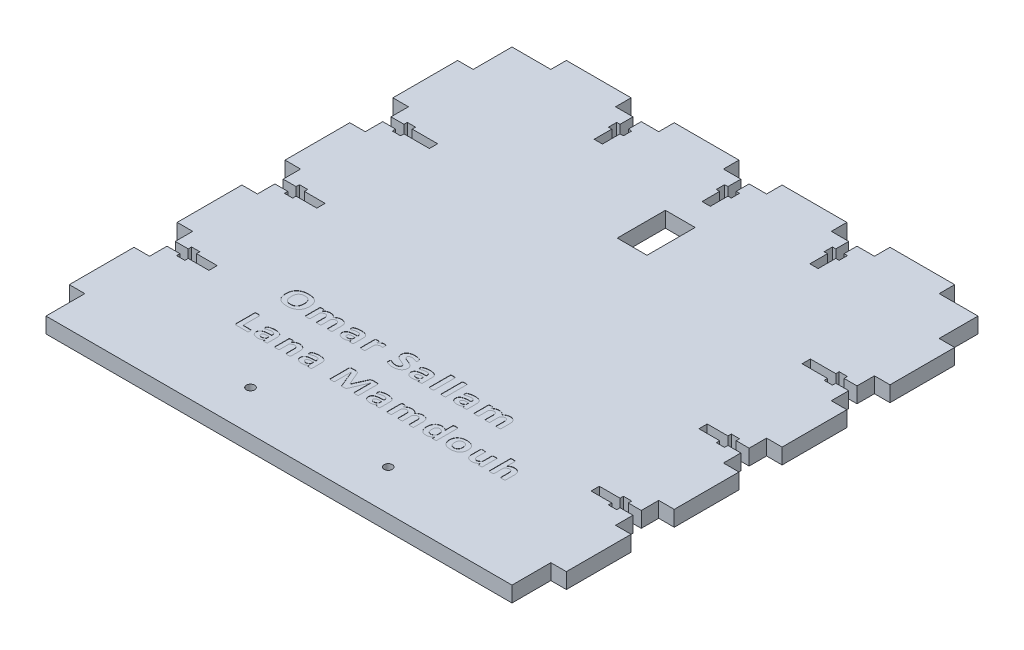
from build123d import *

# Parameters (mm, degrees)
SKETCH1_R           = 1.6
SKETCH1_W           = 11.5
SKETCH1_H           = 18.6
BOSS_EXTRUDE1_DEPTH = 6
CUT_EXTRUDE1_DEPTH  = 0.1


with BuildPart() as part:
    # Sketch1 → Boss-Extrude1 (new body)
    with BuildSketch(Plane(origin=(0, 0, 0), x_dir=(1, 0, 0), z_dir=(0, 1, 0))):
        Polygon((85, 43.266666667), (90, 43.266666667), (90, 50), (96, 50), (96, 75), (90, 75), (90, 90), (75, 90), (75, 96), (50, 96), (50, 90), (43.266666667, 90), (43.266666667, 85), (44.566666667, 85), (44.566666667, 81.8), (43.266666667, 81.8), (43.266666667, 75), (40.066666667, 75), (40.066666667, 81.8), (38.766666667, 81.8), (38.766666667, 85), (40.066666667, 85), (40.066666667, 90), (33.333333333, 90), (33.333333333, 96), (8.333333333, 96), (8.333333333, 90), (1.6, 90), (1.6, 85), (2.9, 85), (2.9, 81.8), (1.6, 81.8), (1.6, 75), (-1.6, 75), (-1.6, 81.8), (-2.9, 81.8), (-2.9, 85), (-1.6, 85), (-1.6, 90), (-8.333333333, 90), (-8.333333333, 96), (-33.333333333, 96), (-33.333333333, 90), (-40.066666667, 90), (-40.066666667, 85), (-38.766666667, 85), (-38.766666667, 81.8), (-40.066666667, 81.8), (-40.066666667, 75), (-43.266666667, 75), (-43.266666667, 81.8), (-44.566666667, 81.8), (-44.566666667, 85), (-43.266666667, 85), (-43.266666667, 90), (-50, 90), (-50, 96), (-75, 96), (-75, 90), (-90, 90), (-90, 75), (-96, 75), (-96, 50), (-90, 50), (-90, 43.266666667), (-85, 43.266666667), (-85, 44.566666667), (-81.8, 44.566666667), (-81.8, 43.266666667), (-72, 43.266666667), (-72, 40.066666667), (-81.8, 40.066666667), (-81.8, 38.766666667), (-85, 38.766666667), (-85, 40.066666667), (-90, 40.066666667), (-90, 33.333333333), (-96, 33.333333333), (-96, 8.333333333), (-90, 8.333333333), (-90, 1.6), (-85, 1.6), (-85, 2.9), (-81.8, 2.9), (-81.8, 1.6), (-73.8, 1.6), (-73.8, -1.6), (-81.8, -1.6), (-81.8, -2.9), (-85, -2.9), (-85, -1.6), (-90, -1.6), (-90, -8.333333333), (-96, -8.333333333), (-96, -33.333333333), (-90, -33.333333333), (-90, -40.066666667), (-85, -40.066666667), (-85, -38.766666667), (-81.8, -38.766666667), (-81.8, -40.066666667), (-73.8, -40.066666667), (-73.8, -43.266666667), (-81.8, -43.266666667), (-81.8, -44.566666667), (-85, -44.566666667), (-85, -43.266666667), (-90, -43.266666667), (-90, -50), (-96, -50), (-96, -75), (-90, -75), (-90, -90), (90, -90), (90, -75), (96, -75), (96, -50), (90, -50), (90, -43.266666667), (85, -43.266666667), (85, -44.566666667), (81.8, -44.566666667), (81.8, -43.266666667), (73.8, -43.266666667), (73.8, -40.066666667), (81.8, -40.066666667), (81.8, -38.766666667), (85, -38.766666667), (85, -40.066666667), (90, -40.066666667), (90, -33.333333333), (96, -33.333333333), (96, -8.333333333), (90, -8.333333333), (90, -1.6), (85, -1.6), (85, -2.9), (81.8, -2.9), (81.8, -1.6), (73.8, -1.6), (73.8, 1.6), (81.8, 1.6), (81.8, 2.9), (85, 2.9), (85, 1.6), (90, 1.6), (90, 8.333333333), (96, 8.333333333), (96, 33.333333333), (90, 33.333333333), (90, 40.066666667), (85, 40.066666667), (85, 38.766666667), (81.8, 38.766666667), (81.8, 40.066666667), (72, 40.066666667), (72, 43.266666667), (81.8, 43.266666667), (81.8, 44.566666667), (85, 44.566666667), align=None)
        with Locations(Location((-26.6, -74.4, 0), (0, 0, 270))):
            Circle(SKETCH1_R, mode=Mode.SUBTRACT)
        with Locations(Location((26.6, -74.4, 0), (0, 0, 270))):
            Circle(SKETCH1_R, mode=Mode.SUBTRACT)
        with Locations((0, 55.7)):
            Rectangle(SKETCH1_W, SKETCH1_H, mode=Mode.SUBTRACT)
    extrude(amount=BOSS_EXTRUDE1_DEPTH)

    # Sketch2 → Cut-Extrude1 (cut)
    # profile 1 of 21: a face of its own
    with BuildSketch(Plane(origin=(0, 6, 0), x_dir=(1, 0, 0), z_dir=(0, 1, 0))):
        with BuildLine():
            add(Edge.make_bspline(
                [(-42.251905626, -35.945553539), (-42.255256211, -36.105417341), (-42.26180017, -36.417644138), (-42.316745648, -36.873383505), (-42.40901549, -37.303590551), (-42.537595043, -37.70737375), (-42.700973357, -38.084048948), (-42.90108282, -38.431189144), (-43.139642389, -38.747900347), (-43.412784182, -39.034775933), (-43.718927478, -39.294007434), (-44.064129968, -39.513879636), (-44.43932414, -39.70910018), (-44.851807761, -39.864811578), (-45.2959494, -39.990957837), (-45.774157061, -40.078592557), (-46.285192797, -40.131413726), (-46.637133729, -40.138114411), (-46.81814882, -40.141560799)],
                knots=[0, 0, 0, 0, 1.087150692, 2.123292287, 3.116860257, 4.075983348, 5.001054018, 5.904491279, 6.794987174, 7.691500289, 8.594046794, 9.516294157, 10.469635372, 11.466164448, 12.509610102, 13.606444947, 14.768913913, 16, 16, 16, 16], degree=3))
            add(Edge.make_bspline(
                [(-46.81814882, -40.141560799), (-46.996105198, -40.139075412), (-47.341141946, -40.134256537), (-47.841540361, -40.088614964), (-48.307316251, -40.012736397), (-48.739402724, -39.909594661), (-49.135730841, -39.771179744), (-49.497815812, -39.601874819), (-49.827368845, -39.402244613), (-50.121841619, -39.168095837), (-50.38270064, -38.901563375), (-50.604512251, -38.598276941), (-50.794975725, -38.263794052), (-50.948926568, -37.894213871), (-51.068541671, -37.490748015), (-51.151808384, -37.052966594), (-51.206356669, -36.580927634), (-51.211258212, -36.254246472), (-51.213793103, -36.085299456)],
                knots=[0, 0, 0, 0, 1.240818448, 2.405802854, 3.500282578, 4.52967051, 5.49969859, 6.42259886, 7.31257875, 8.180331579, 9.039581621, 9.905321956, 10.79334975, 11.717945643, 12.691014916, 13.722786253, 14.822312044, 16, 16, 16, 16], degree=3))
            add(Edge.make_bspline(
                [(-51.213793103, -36.085299456), (-51.210422366, -35.929065142), (-51.203829245, -35.623472822), (-51.148925873, -35.176750859), (-51.056252238, -34.754714365), (-50.929630967, -34.356604452), (-50.766599924, -33.984734616), (-50.565330124, -33.640864247), (-50.328949567, -33.325530668), (-50.055790161, -33.040100113), (-49.748039367, -32.784903039), (-49.404089284, -32.563464357), (-49.027671811, -32.371994081), (-48.617279242, -32.212711395), (-48.172508124, -32.084290229), (-47.691942222, -31.998582276), (-47.178231301, -31.942200762), (-46.824359138, -31.936028334), (-46.642105263, -31.932849365)],
                knots=[0, 0, 0, 0, 1.068038417, 2.08906949, 3.071669975, 4.018792723, 4.941128977, 5.842143599, 6.737299404, 7.629659993, 8.537457401, 9.464530828, 10.420975229, 11.420359055, 12.470398168, 13.58110588, 14.754203152, 16, 16, 16, 16], degree=3))
            add(Edge.make_bspline(
                [(-46.642105263, -31.932849365), (-46.467760679, -31.935256431), (-46.129332182, -31.9399289), (-45.63771929, -31.986843501), (-45.17738022, -32.058944698), (-44.749157641, -32.165186893), (-44.351042704, -32.296768307), (-43.988361032, -32.466966466), (-43.658176234, -32.666562117), (-43.36424175, -32.901331782), (-43.101272861, -33.16585497), (-42.875980053, -33.465986053), (-42.68378192, -33.798128603), (-42.525965356, -34.163011092), (-42.403043823, -34.561102447), (-42.314316935, -34.992492185), (-42.26207357, -35.45787829), (-42.255364514, -35.779658231), (-42.251905626, -35.945553539)],
                knots=[0, 0, 0, 0, 1.22537038, 2.378624248, 3.468700891, 4.498175041, 5.47731627, 6.411551116, 7.308747282, 8.18353616, 9.049690658, 9.92413828, 10.814107609, 11.741726136, 12.712965401, 13.738107943, 14.833869887, 16, 16, 16, 16], degree=3))
        make_face()
        with BuildLine():
            add(Edge.make_bspline(
                [(-44.271869328, -36.030852995), (-44.273286367, -35.929190379), (-44.276064783, -35.729858525), (-44.297088733, -35.4381928), (-44.336619077, -35.161048403), (-44.385214867, -34.897728776), (-44.453775588, -34.650102033), (-44.542252472, -34.420420322), (-44.652291308, -34.209052566), (-44.782935061, -34.015859558), (-44.936107046, -33.841262373), (-45.114533089, -33.690413424), (-45.314096214, -33.557694825), (-45.539685005, -33.449136685), (-45.790904362, -33.361497052), (-46.070734593, -33.298020598), (-46.379875743, -33.263178123), (-46.59543737, -33.258387517), (-46.707441016, -33.255898367)],
                knots=[0, 0, 0, 0, 1.146469355, 2.247904599, 3.294742534, 4.302249321, 5.265618353, 6.187940337, 7.072867734, 7.947079567, 8.812220042, 9.683178139, 10.574394705, 11.508051795, 12.498412244, 13.569185641, 14.73697339, 16, 16, 16, 16], degree=3))
            add(Edge.make_bspline(
                [(-46.707441016, -33.255898367), (-46.820711762, -33.258595846), (-47.03899866, -33.263794225), (-47.351565357, -33.30571974), (-47.636169485, -33.372941813), (-47.890823585, -33.472463722), (-48.118753596, -33.594978201), (-48.323731725, -33.735691874), (-48.50748652, -33.893756463), (-48.665147157, -34.073498925), (-48.803046471, -34.268080974), (-48.914631921, -34.481679054), (-49.010662003, -34.707896635), (-49.079205748, -34.950529171), (-49.132070805, -35.202932332), (-49.166480709, -35.463924884), (-49.192335394, -35.732095011), (-49.194530383, -35.913424577), (-49.195644283, -36.005444646)],
                knots=[0, 0, 0, 0, 1.283130844, 2.47275368, 3.566806342, 4.589087552, 5.561345502, 6.493098922, 7.401768109, 8.300138367, 9.195915391, 10.097601401, 11.025716132, 11.975874424, 12.94929178, 13.945944097, 14.9576197, 16, 16, 16, 16], degree=3))
            add(Edge.make_bspline(
                [(-49.195644283, -36.005444646), (-49.194294919, -36.110743924), (-49.191655213, -36.316736672), (-49.169829037, -36.617276975), (-49.133390378, -36.902007905), (-49.084412551, -37.170077872), (-49.015590078, -37.42065694), (-48.926743203, -37.652594625), (-48.81719704, -37.866096244), (-48.689052256, -38.06263089), (-48.53478375, -38.235815689), (-48.358719982, -38.389092683), (-48.157320507, -38.51717848), (-47.933228063, -38.626176382), (-47.681176285, -38.709432411), (-47.399946867, -38.768097942), (-47.088898251, -38.804339169), (-46.871489712, -38.808884791), (-46.758257713, -38.811252269)],
                knots=[0, 0, 0, 0, 1.175963286, 2.300489733, 3.363150202, 4.380869233, 5.341474972, 6.261220106, 7.14963274, 8.017273842, 8.87408737, 9.731540033, 10.616141931, 11.531782982, 12.50822628, 13.57236784, 14.735626286, 16, 16, 16, 16], degree=3))
            add(Edge.make_bspline(
                [(-46.758257713, -38.811252269), (-46.645020834, -38.808314714), (-46.426877673, -38.802655716), (-46.113938259, -38.763941713), (-45.829900028, -38.695498928), (-45.575061784, -38.598287156), (-45.34604324, -38.477915009), (-45.142040459, -38.335490737), (-44.959999555, -38.174489553), (-44.801599819, -37.993516501), (-44.665158315, -37.795526917), (-44.552346805, -37.580481361), (-44.458927996, -37.350971167), (-44.389569788, -37.105223986), (-44.338151571, -36.848233009), (-44.300206161, -36.582847709), (-44.275386188, -36.309607412), (-44.273053039, -36.124676649), (-44.271869328, -36.030852995)],
                knots=[0, 0, 0, 0, 1.274228133, 2.454714009, 3.541175835, 4.553918792, 5.516233524, 6.445395951, 7.347143999, 8.244383601, 9.145128863, 10.046568481, 10.971957313, 11.928596333, 12.915261662, 13.919433485, 14.944435468, 16, 16, 16, 16], degree=3))
        make_face(mode=Mode.SUBTRACT)
    # profile 2 of 21: a face of its own
    with BuildSketch(Plane(origin=(0, 6, 0), x_dir=(1, 0, 0), z_dir=(0, 1, 0))):
        with BuildLine():
            add(Edge.make_bspline(
                [(-29.566969147, -39.791288566), (-29.569060528, -39.811111543), (-29.573290118, -39.851201351), (-29.610224928, -39.906179606), (-29.674305952, -39.948589548), (-29.765531067, -39.981668727), (-29.889206134, -40.005198359), (-30.04793323, -40.025297097), (-30.249871888, -40.034566258), (-30.398788264, -40.035678569), (-30.481669691, -40.036297641)],
                knots=[0, 0, 0, 0, 0.465817955, 0.942065963, 1.505897053, 2.257823099, 3.223127794, 4.477788977, 6.039665732, 8, 8, 8, 8], degree=3))
            add(Edge.make_bspline(
                [(-30.481669691, -40.036297641), (-30.565751666, -40.03563569), (-30.717069301, -40.034444414), (-30.921526475, -40.025645154), (-31.082411918, -40.004603887), (-31.207803364, -39.982348554), (-31.299433758, -39.94826333), (-31.364696767, -39.907294286), (-31.396583746, -39.850072914), (-31.401273647, -39.810945457), (-31.403629764, -39.791288566)],
                knots=[0, 0, 0, 0, 1.971608681, 3.548194057, 4.791918416, 5.776574321, 6.521945863, 7.080862064, 7.538242559, 8, 8, 8, 8], degree=3))
            Line((-31.403629764, -39.791288566), (-31.403629764, -36.551724138))
            add(Edge.make_bspline(
                [(-31.403629764, -36.551724138), (-31.405860364, -36.463751557), (-31.410157452, -36.294278785), (-31.458248187, -36.053929054), (-31.53380671, -35.839122466), (-31.64904039, -35.657960179), (-31.794416724, -35.507646334), (-31.945227986, -35.417557309), (-32.080127619, -35.368084638), (-32.191625822, -35.338002228), (-32.313657614, -35.322495102), (-32.398147892, -35.320466127), (-32.441742287, -35.319419238)],
                knots=[0, 0, 0, 0, 1.439546889, 2.773182273, 3.999532424, 5.149079265, 6.263600988, 7.397526915, 7.990393935, 8.61553153, 9.285656687, 10, 10, 10, 10], degree=3))
            add(Edge.make_bspline(
                [(-32.441742287, -35.319419238), (-32.49707984, -35.321591937), (-32.609326978, -35.325999057), (-32.776273524, -35.371851995), (-32.944905713, -35.43899722), (-33.114209603, -35.535742892), (-33.286696775, -35.656845704), (-33.465370295, -35.802034697), (-33.651888292, -35.970525335), (-33.775083292, -36.094950964), (-33.839201452, -36.159709619)],
                knots=[0, 0, 0, 0, 0.792105886, 1.60671393, 2.467318722, 3.392051089, 4.395984772, 5.488448085, 6.69283584, 8, 8, 8, 8], degree=3))
            Line((-33.839201452, -36.159709619), (-33.839201452, -39.791288566))
            add(Edge.make_bspline(
                [(-33.839201452, -39.791288566), (-33.841302749, -39.811097677), (-33.845552392, -39.85115944), (-33.882609946, -39.906792976), (-33.948655923, -39.948357976), (-34.041921964, -39.98197354), (-34.167605231, -40.004713994), (-34.32739432, -40.025421589), (-34.526955407, -40.034411518), (-34.673444362, -40.035628968), (-34.753901996, -40.036297641)],
                knots=[0, 0, 0, 0, 0.466061359, 0.942558221, 1.518368514, 2.284051671, 3.27788529, 4.533202072, 6.095894956, 8, 8, 8, 8], degree=3))
            add(Edge.make_bspline(
                [(-34.753901996, -40.036297641), (-34.836173575, -40.035635111), (-34.985080054, -40.034435972), (-35.187070382, -40.025513836), (-35.347458223, -40.00471125), (-35.473141569, -39.981974039), (-35.566407596, -39.948357889), (-35.632453575, -39.906792992), (-35.669511128, -39.851159436), (-35.673760772, -39.811097675), (-35.675862069, -39.791288566)],
                knots=[0, 0, 0, 0, 1.933214563, 3.49899902, 4.7453988, 5.732172834, 6.492417046, 7.064137135, 7.537249255, 8, 8, 8, 8], degree=3))
            Line((-35.675862069, -39.791288566), (-35.675862069, -36.551724138))
            add(Edge.make_bspline(
                [(-35.675862069, -36.551724138), (-35.678118451, -36.463766513), (-35.682465206, -36.294322552), (-35.730213596, -36.053774234), (-35.806712001, -35.840243288), (-35.917269347, -35.657626446), (-36.061709641, -35.506689535), (-36.213804264, -35.417250696), (-36.350056059, -35.368406979), (-36.461452217, -35.338159927), (-36.58164814, -35.322547736), (-36.664329702, -35.32047949), (-36.706715064, -35.319419238)],
                knots=[0, 0, 0, 0, 1.443770599, 2.781318942, 4.011267272, 5.153679802, 6.264508472, 7.410290322, 8.014215844, 8.641187626, 9.303426872, 10, 10, 10, 10], degree=3))
            add(Edge.make_bspline(
                [(-36.706715064, -35.319419238), (-36.763252848, -35.321600109), (-36.877867491, -35.326021218), (-37.047945995, -35.37150976), (-37.218476824, -35.438651277), (-37.388033986, -35.535217695), (-37.558985034, -35.657594769), (-37.737412423, -35.800885006), (-37.92030755, -35.970831431), (-38.041210551, -36.09502979), (-38.104174229, -36.159709619)],
                knots=[0, 0, 0, 0, 0.808404021, 1.63881444, 2.506393931, 3.429973, 4.425548234, 5.516649061, 6.706724358, 8, 8, 8, 8], degree=3))
            Line((-38.104174229, -36.159709619), (-38.104174229, -39.791288566))
            add(Edge.make_bspline(
                [(-38.104174229, -39.791288566), (-38.10614555, -39.811195325), (-38.110165708, -39.8517916), (-38.149544704, -39.905587704), (-38.213534531, -39.949158081), (-38.307118378, -39.981722004), (-38.432492856, -40.004807284), (-38.59299779, -40.025477916), (-38.794945137, -40.034448489), (-38.94385877, -40.035639565), (-39.026134301, -40.036297641)],
                knots=[0, 0, 0, 0, 0.462968746, 0.944142006, 1.504524383, 2.265126746, 3.252365648, 4.499352606, 6.065874702, 8, 8, 8, 8], degree=3))
            add(Edge.make_bspline(
                [(-39.026134301, -40.036297641), (-39.10840185, -40.035620384), (-39.257301035, -40.034394592), (-39.459335183, -40.025632585), (-39.620191127, -40.004315917), (-39.746215187, -39.982694401), (-39.839073326, -39.947909251), (-39.904695821, -39.906820303), (-39.941741205, -39.851153315), (-39.94599234, -39.81109565), (-39.948094374, -39.791288566)],
                knots=[0, 0, 0, 0, 1.933056022, 3.498712071, 4.745009636, 5.745627002, 6.492540681, 7.064213884, 7.537287205, 8, 8, 8, 8], degree=3))
            Line((-39.948094374, -39.791288566), (-39.948094374, -34.328493648))
            add(Edge.make_bspline(
                [(-39.948094374, -34.328493648), (-39.946528258, -34.308743109), (-39.943468625, -34.270157581), (-39.912189097, -34.216184315), (-39.857638351, -34.170447621), (-39.772986617, -34.141318687), (-39.664617633, -34.113624235), (-39.524914028, -34.097895353), (-39.353702351, -34.08419767), (-39.227634191, -34.083736844), (-39.15862069, -34.083484574)],
                knots=[0, 0, 0, 0, 0.525058093, 1.025776781, 1.623622421, 2.394301966, 3.396919586, 4.623532008, 6.15161988, 8, 8, 8, 8], degree=3))
            add(Edge.make_bspline(
                [(-39.15862069, -34.083484574), (-39.087180472, -34.08370143), (-38.957473463, -34.084095156), (-38.782698344, -34.09791643), (-38.643904449, -34.112802137), (-38.540449892, -34.140950977), (-38.461556303, -34.171035295), (-38.412577976, -34.217910148), (-38.378708858, -34.269500072), (-38.375978376, -34.308623899), (-38.374591652, -34.328493648)],
                knots=[0, 0, 0, 0, 1.923158432, 3.491690479, 4.724677287, 5.66940127, 6.38418263, 6.960780255, 7.472213316, 8, 8, 8, 8], degree=3))
            Line((-38.374591652, -34.328493648), (-38.374591652, -34.958257713))
            add(Edge.make_bspline(
                [(-38.374591652, -34.958257713), (-38.28568335, -34.879909991), (-38.112938104, -34.727683525), (-37.840469954, -34.530594523), (-37.571930812, -34.359673281), (-37.301470384, -34.22007212), (-37.027463001, -34.111420755), (-36.74739082, -34.035616073), (-36.462288731, -33.985632192), (-36.269535421, -33.980691999), (-36.173139746, -33.978221416)],
                knots=[0, 0, 0, 0, 1.151864629, 2.238026539, 3.266419186, 4.245266776, 5.193597812, 6.127065997, 7.063348182, 8, 8, 8, 8], degree=3))
            add(Edge.make_bspline(
                [(-36.173139746, -33.978221416), (-36.107765874, -33.978533247), (-35.979867644, -33.979143317), (-35.793456669, -33.995117498), (-35.616929908, -34.015629883), (-35.400042234, -34.056794573), (-35.148309189, -34.124645569), (-34.877104624, -34.243822447), (-34.637618107, -34.386922243), (-34.437593004, -34.562615218), (-34.265372225, -34.757475788), (-34.175964331, -34.90357895), (-34.131397459, -34.976406534)],
                knots=[0, 0, 0, 0, 0.81960473, 1.60348458, 2.345095532, 3.047515189, 4.371181845, 5.604633015, 6.7523987, 7.855218627, 8.930897569, 10, 10, 10, 10], degree=3))
            add(Edge.make_bspline(
                [(-34.131397459, -34.976406534), (-34.035790419, -34.893277358), (-33.851942557, -34.733423847), (-33.566376597, -34.52518618), (-33.286587509, -34.351152762), (-33.008590245, -34.211397212), (-32.732022292, -34.105016209), (-32.454411295, -34.032095386), (-32.175263965, -33.986530247), (-31.987587598, -33.980993023), (-31.893647913, -33.978221416)],
                knots=[0, 0, 0, 0, 1.211464895, 2.329590261, 3.376708782, 4.360150134, 5.301628694, 6.205597999, 7.101828527, 8, 8, 8, 8], degree=3))
            add(Edge.make_bspline(
                [(-31.893647913, -33.978221416), (-31.789491649, -33.980022888), (-31.588425337, -33.983500502), (-31.299748788, -34.018037116), (-31.035945409, -34.074914563), (-30.798705075, -34.15762531), (-30.584768799, -34.257753967), (-30.391901299, -34.374501229), (-30.221053763, -34.508447309), (-30.072661318, -34.659245249), (-29.944312792, -34.823491523), (-29.837770111, -35.002895442), (-29.746845352, -35.19409895), (-29.681845868, -35.399995211), (-29.631831107, -35.614500168), (-29.592897547, -35.835491834), (-29.571201058, -36.063081301), (-29.568388978, -36.216532649), (-29.566969147, -36.294010889)],
                knots=[0, 0, 0, 0, 1.332627564, 2.572543416, 3.714752764, 4.779960248, 5.781011847, 6.733164367, 7.659495859, 8.551972882, 9.434824955, 10.320558572, 11.217759235, 12.138442509, 13.077501933, 14.036055762, 15.008396186, 16, 16, 16, 16], degree=3))
            Line((-29.566969147, -36.294010889), (-29.566969147, -39.791288566))
        make_face()
    # profile 3 of 21: a face of its own
    with BuildSketch(Plane(origin=(0, 6, 0), x_dir=(1, 0, 0), z_dir=(0, 1, 0))):
        with BuildLine():
            add(Edge.make_bspline(
                [(-21.366606171, -39.809437387), (-21.369681571, -39.836800841), (-21.375860645, -39.89177931), (-21.445109315, -39.955167908), (-21.545866875, -39.994007873), (-21.654284799, -40.015722767), (-21.76507615, -40.026816707), (-21.871716752, -40.031301829), (-21.99755318, -40.035099138), (-22.087714859, -40.035878993), (-22.136116152, -40.036297641)],
                knots=[0, 0, 0, 0, 0.737914163, 1.482612154, 2.433004169, 3.714819661, 4.521468793, 5.508913167, 6.66271541, 8, 8, 8, 8], degree=3))
            add(Edge.make_bspline(
                [(-22.136116152, -40.036297641), (-22.18693535, -40.035875307), (-22.281327574, -40.035090859), (-22.41202615, -40.031386465), (-22.521026845, -40.026785761), (-22.629695036, -40.016372187), (-22.731499595, -39.993970129), (-22.825944491, -39.95613094), (-22.880827795, -39.888060105), (-22.886397731, -39.836323016), (-22.889292196, -39.809437387)],
                knots=[0, 0, 0, 0, 1.420701649, 2.638829323, 3.654811915, 4.47097617, 5.685341278, 6.57027256, 7.257029654, 8, 8, 8, 8], degree=3))
            Line((-22.889292196, -39.809437387), (-22.889292196, -39.375680581))
            add(Edge.make_bspline(
                [(-22.889292196, -39.375680581), (-22.95783607, -39.433872083), (-23.094474939, -39.549874004), (-23.318758486, -39.700830243), (-23.555697707, -39.833587628), (-23.807932931, -39.944427206), (-24.073265862, -40.035113963), (-24.354249252, -40.094720684), (-24.648565336, -40.134963023), (-24.849827397, -40.139327499), (-24.952813067, -40.141560799)],
                knots=[0, 0, 0, 0, 0.957364127, 1.908458669, 2.875086468, 3.847606107, 4.840252182, 5.856781497, 6.903316433, 8, 8, 8, 8], degree=3))
            add(Edge.make_bspline(
                [(-24.952813067, -40.141560799), (-25.037563461, -40.140279874), (-25.203723486, -40.137768518), (-25.447834536, -40.114694508), (-25.682045087, -40.081351539), (-25.905346713, -40.032469847), (-26.116184216, -39.969483599), (-26.312270051, -39.891563204), (-26.494034908, -39.800086577), (-26.661250969, -39.695294639), (-26.812483205, -39.576189806), (-26.943959713, -39.441079394), (-27.061282559, -39.296760107), (-27.158555557, -39.13694757), (-27.234476263, -38.963416755), (-27.291869939, -38.776802646), (-27.324373167, -38.575244141), (-27.328292019, -38.436291619), (-27.33030853, -38.364791289)],
                knots=[0, 0, 0, 0, 1.217239217, 2.386496266, 3.519733186, 4.614180643, 5.667229518, 6.677520783, 7.641440621, 8.586646398, 9.508263318, 10.399378908, 11.289773719, 12.175149306, 13.077886437, 14.004407783, 14.973134841, 16, 16, 16, 16], degree=3))
            add(Edge.make_bspline(
                [(-27.33030853, -38.364791289), (-27.327543746, -38.287757135), (-27.322145612, -38.137350949), (-27.279374675, -37.91992108), (-27.210977219, -37.717385077), (-27.110903759, -37.531975778), (-26.984171567, -37.361691511), (-26.830241404, -37.205730714), (-26.647014246, -37.068411469), (-26.437780573, -36.946387123), (-26.201757779, -36.839175914), (-25.938334652, -36.748081198), (-25.648656311, -36.669460347), (-25.331625852, -36.609665007), (-24.988943603, -36.560459385), (-24.619443871, -36.52667759), (-24.224051406, -36.507073794), (-23.951626199, -36.504202058), (-23.811252269, -36.502722323)],
                knots=[0, 0, 0, 0, 0.829278197, 1.619133407, 2.377553904, 3.123923343, 3.87858273, 4.657364718, 5.475895541, 6.33762196, 7.26204798, 8.263734177, 9.337133918, 10.492507936, 11.736694066, 13.065393046, 14.487870052, 16, 16, 16, 16], degree=3))
            Line((-23.811252269, -36.502722323), (-23.174228675, -36.502722323))
            Line((-23.174228675, -36.502722323), (-23.174228675, -36.172413793))
            add(Edge.make_bspline(
                [(-23.174228675, -36.172413793), (-23.177096758, -36.091684526), (-23.182501551, -35.939553268), (-23.229459747, -35.726218824), (-23.310169104, -35.540899646), (-23.416835312, -35.416848011), (-23.519605302, -35.336499864), (-23.608650204, -35.283101991), (-23.711655874, -35.242809044), (-23.825042464, -35.207864404), (-23.951389345, -35.181069418), (-24.091384519, -35.160980962), (-24.246067168, -35.150825397), (-24.353889721, -35.149507927), (-24.410163339, -35.148820327)],
                knots=[0, 0, 0, 0, 1.558500304, 2.936935009, 4.197700644, 5.425232523, 6.049706095, 6.715392492, 7.423175557, 8.181309912, 9.00685218, 9.916222687, 10.91245677, 12, 12, 12, 12], degree=3))
            add(Edge.make_bspline(
                [(-24.410163339, -35.148820327), (-24.485222953, -35.149702276), (-24.630690045, -35.151411511), (-24.843125491, -35.169320842), (-25.043671337, -35.192174284), (-25.287320244, -35.244427593), (-25.564346112, -35.317986837), (-25.862389674, -35.417151652), (-26.115835565, -35.517957539), (-26.299301234, -35.596437122), (-26.42354553, -35.65381006), (-26.504409226, -35.67819186), (-26.575684833, -35.696940576), (-26.621195529, -35.699396508), (-26.64246824, -35.700544465)],
                knots=[0, 0, 0, 0, 1.165376349, 2.258523593, 3.309680567, 4.29732038, 6.125066905, 7.759172583, 9.17239899, 10.359204253, 10.860079404, 11.293900882, 11.669953578, 12, 12, 12, 12], degree=3))
            add(Edge.make_bspline(
                [(-26.64246824, -35.700544465), (-26.668264617, -35.698587926), (-26.719078899, -35.694733891), (-26.788892683, -35.659551525), (-26.845573426, -35.604851012), (-26.892627135, -35.533099008), (-26.924899593, -35.442004482), (-26.952523975, -35.335318003), (-26.967984978, -35.212773371), (-26.969944548, -35.126473515), (-26.970961887, -35.081669691)],
                knots=[0, 0, 0, 0, 0.793769609, 1.563585185, 2.357795655, 3.208813094, 4.192076898, 5.331043323, 6.614372383, 8, 8, 8, 8], degree=3))
            add(Edge.make_bspline(
                [(-26.970961887, -35.081669691), (-26.969638591, -35.02472621), (-26.967295164, -34.923884896), (-26.941804715, -34.784825099), (-26.884899585, -34.671174475), (-26.811845663, -34.590655987), (-26.730719149, -34.533377726), (-26.651059198, -34.483554576), (-26.549957795, -34.436509138), (-26.387064872, -34.362602357), (-26.148215834, -34.27626978), (-25.828130919, -34.180023439), (-25.469683516, -34.098526086), (-25.081712979, -34.03131567), (-24.671939337, -33.986157843), (-24.392133239, -33.980889192), (-24.250453721, -33.978221416)],
                knots=[0, 0, 0, 0, 0.748462208, 1.32545307, 1.841051408, 2.398367894, 2.733920385, 3.144386315, 3.631550825, 4.197478719, 5.495680767, 6.964767867, 8.588764195, 10.32338524, 12.138350047, 14, 14, 14, 14], degree=3))
            add(Edge.make_bspline(
                [(-24.250453721, -33.978221416), (-24.127000712, -33.979371256), (-23.888923911, -33.981588702), (-23.54599194, -34.005238448), (-23.23065834, -34.044170926), (-22.943353156, -34.10051773), (-22.680985698, -34.170134627), (-22.444110599, -34.259404259), (-22.230570028, -34.364001768), (-22.040905471, -34.486234067), (-21.87597197, -34.627667727), (-21.732775982, -34.785807875), (-21.615198615, -34.9647327), (-21.522871393, -35.162638442), (-21.452280201, -35.379166505), (-21.401629674, -35.613852452), (-21.373309521, -35.868032764), (-21.368892412, -36.043487882), (-21.366606171, -36.13430127)],
                knots=[0, 0, 0, 0, 1.42762126, 2.753140691, 3.973335015, 5.099906493, 6.1369916, 7.1090431, 8.02273498, 8.882459038, 9.711188402, 10.528736692, 11.341841752, 12.177512609, 13.047060139, 13.970664049, 14.949640939, 16, 16, 16, 16], degree=3))
            Line((-21.366606171, -36.13430127), (-21.366606171, -39.809437387))
        make_face()
        with BuildLine():
            Line((-23.174228675, -37.470054446), (-23.876588022, -37.470054446))
            add(Edge.make_bspline(
                [(-23.876588022, -37.470054446), (-23.947994527, -37.470639222), (-24.086055796, -37.471769859), (-24.284525422, -37.483493774), (-24.467714371, -37.498180909), (-24.633491898, -37.524204656), (-24.784635585, -37.554544311), (-24.919805016, -37.592458659), (-25.0419022, -37.635630647), (-25.148543823, -37.687461099), (-25.239926176, -37.747528544), (-25.322452766, -37.807600286), (-25.386741975, -37.879748479), (-25.458797777, -37.979003778), (-25.516932066, -38.126340257), (-25.525501859, -38.251098555), (-25.529945554, -38.315789474)],
                knots=[0, 0, 0, 0, 1.444943216, 2.793732743, 4.023033669, 5.162405157, 6.187722541, 7.141303574, 8.001144149, 8.806056854, 9.53287264, 10.213682981, 10.863513082, 11.478376907, 12.692462823, 14, 14, 14, 14], degree=3))
            add(Edge.make_bspline(
                [(-25.529945554, -38.315789474), (-25.527058874, -38.370048133), (-25.521447527, -38.475520249), (-25.470551699, -38.623675448), (-25.388323885, -38.754245817), (-25.271220845, -38.860913193), (-25.126937871, -38.947354232), (-24.956148523, -39.008043942), (-24.76072814, -39.044118191), (-24.622670818, -39.048504789), (-24.549909256, -39.050816697)],
                knots=[0, 0, 0, 0, 0.94137686, 1.82992007, 2.691120811, 3.59944814, 4.557789161, 5.599837928, 6.73502151, 8, 8, 8, 8], degree=3))
            add(Edge.make_bspline(
                [(-24.549909256, -39.050816697), (-24.486251444, -39.048700086), (-24.361197488, -39.044542065), (-24.177968576, -39.0123739), (-24.002053606, -38.962111804), (-23.833423891, -38.887738764), (-23.669014516, -38.792999431), (-23.503176552, -38.681827324), (-23.335867343, -38.551320785), (-23.229154761, -38.452138891), (-23.174228675, -38.401088929)],
                knots=[0, 0, 0, 0, 0.977591143, 1.920449914, 2.849972746, 3.782465308, 4.744016131, 5.762342227, 6.848254068, 8, 8, 8, 8], degree=3))
            Line((-23.174228675, -38.401088929), (-23.174228675, -37.470054446))
        make_face(mode=Mode.SUBTRACT)
    # profile 4 of 21: a face of its own
    with BuildSketch(Plane(origin=(0, 6, 0), x_dir=(1, 0, 0), z_dir=(0, 1, 0))):
        with BuildLine():
            add(Edge.make_bspline(
                [(-14.476588022, -34.836660617), (-14.477115491, -34.903231281), (-14.478070628, -35.023777002), (-14.488422683, -35.186178129), (-14.504928797, -35.314893821), (-14.531210957, -35.411413135), (-14.563600647, -35.483559866), (-14.609398689, -35.530535891), (-14.667813724, -35.556417628), (-14.709825685, -35.55808455), (-14.732486388, -35.558983666)],
                knots=[0, 0, 0, 0, 1.883835604, 3.411237138, 4.605064019, 5.548226099, 6.23741147, 6.818583604, 7.362759412, 8, 8, 8, 8], degree=3))
            add(Edge.make_bspline(
                [(-14.732486388, -35.558983666), (-14.753151178, -35.557809587), (-14.798048526, -35.555258724), (-14.8677936, -35.53663474), (-14.945916448, -35.514474481), (-15.032867054, -35.490715319), (-15.128929203, -35.467011448), (-15.23399301, -35.445041066), (-15.348969249, -35.427149572), (-15.429323583, -35.425526902), (-15.471143376, -35.424682396)],
                knots=[0, 0, 0, 0, 0.657914843, 1.429418481, 2.289937297, 3.248496145, 4.300383099, 5.442042387, 6.668730717, 8, 8, 8, 8], degree=3))
            add(Edge.make_bspline(
                [(-15.471143376, -35.424682396), (-15.522837176, -35.427008414), (-15.627748032, -35.431728991), (-15.78399323, -35.475279858), (-15.943392671, -35.541353301), (-16.106070252, -35.640500352), (-16.276013716, -35.770949719), (-16.45271637, -35.938795119), (-16.638849538, -36.146276234), (-16.760157756, -36.302829646), (-16.825045372, -36.386569873)],
                knots=[0, 0, 0, 0, 0.720326951, 1.461879681, 2.249293214, 3.124161909, 4.112361659, 5.235690559, 6.521374284, 8, 8, 8, 8], degree=3))
            Line((-16.825045372, -36.386569873), (-16.825045372, -39.791288566))
            add(Edge.make_bspline(
                [(-16.825045372, -39.791288566), (-16.827016694, -39.811195325), (-16.831036851, -39.8517916), (-16.870415847, -39.905587704), (-16.934405674, -39.949158081), (-17.027989521, -39.981722004), (-17.153364, -40.004807284), (-17.313868934, -40.025477916), (-17.51581628, -40.034448489), (-17.664729913, -40.035639565), (-17.747005445, -40.036297641)],
                knots=[0, 0, 0, 0, 0.462968746, 0.944142006, 1.504524383, 2.265126746, 3.252365648, 4.499352606, 6.065874702, 8, 8, 8, 8], degree=3))
            add(Edge.make_bspline(
                [(-17.747005445, -40.036297641), (-17.829272993, -40.035620384), (-17.978172178, -40.034394592), (-18.180206326, -40.025632585), (-18.34106227, -40.004315917), (-18.467086331, -39.982694401), (-18.559944469, -39.947909251), (-18.625566964, -39.906820303), (-18.662612349, -39.851153315), (-18.666863483, -39.81109565), (-18.668965517, -39.791288566)],
                knots=[0, 0, 0, 0, 1.933056022, 3.498712071, 4.745009636, 5.745627002, 6.492540681, 7.064213884, 7.537287205, 8, 8, 8, 8], degree=3))
            Line((-18.668965517, -39.791288566), (-18.668965517, -34.328493648))
            add(Edge.make_bspline(
                [(-18.668965517, -34.328493648), (-18.667399402, -34.308743109), (-18.664339769, -34.270157581), (-18.633060241, -34.216184315), (-18.578509494, -34.170447621), (-18.493857761, -34.141318687), (-18.385488776, -34.113624235), (-18.245785171, -34.097895353), (-18.074573494, -34.08419767), (-17.948505335, -34.083736844), (-17.879491833, -34.083484574)],
                knots=[0, 0, 0, 0, 0.525058093, 1.025776781, 1.623622421, 2.394301966, 3.396919586, 4.623532008, 6.15161988, 8, 8, 8, 8], degree=3))
            add(Edge.make_bspline(
                [(-17.879491833, -34.083484574), (-17.808051615, -34.08370143), (-17.678344607, -34.084095156), (-17.503569488, -34.09791643), (-17.364775592, -34.112802137), (-17.261321036, -34.140950977), (-17.182427447, -34.171035295), (-17.133449119, -34.217910148), (-17.099580002, -34.269500072), (-17.09684952, -34.308623899), (-17.095462795, -34.328493648)],
                knots=[0, 0, 0, 0, 1.923158432, 3.491690479, 4.724677287, 5.66940127, 6.38418263, 6.960780255, 7.472213316, 8, 8, 8, 8], degree=3))
            Line((-17.095462795, -34.328493648), (-17.095462795, -35.007259528))
            add(Edge.make_bspline(
                [(-17.095462795, -35.007259528), (-17.053151651, -34.95884276), (-16.971107249, -34.864959104), (-16.851601608, -34.729209472), (-16.729855435, -34.612371721), (-16.582714774, -34.472066632), (-16.403453993, -34.326753717), (-16.191682514, -34.185902114), (-15.98347304, -34.085008616), (-15.775450954, -34.022130617), (-15.568781559, -33.983853082), (-15.430771795, -33.980089848), (-15.362250454, -33.978221416)],
                knots=[0, 0, 0, 0, 0.923609782, 1.790946943, 2.595803068, 3.345744657, 4.710849062, 5.903751647, 6.991908656, 8.019736166, 9.016806285, 10, 10, 10, 10], degree=3))
            add(Edge.make_bspline(
                [(-15.362250454, -33.978221416), (-15.329570178, -33.978477472), (-15.26171152, -33.979009158), (-15.156348764, -33.986860518), (-15.045514115, -33.999271437), (-14.932795589, -34.016993898), (-14.826166138, -34.039614975), (-14.732322867, -34.064902507), (-14.655790151, -34.089224441), (-14.600622302, -34.121509248), (-14.561236955, -34.154913011), (-14.536578295, -34.194843188), (-14.51741578, -34.241314624), (-14.503526009, -34.302590438), (-14.490239172, -34.386105295), (-14.482448326, -34.500794702), (-14.477198259, -34.654510516), (-14.476808967, -34.770710394), (-14.476588022, -34.836660617)],
                knots=[0, 0, 0, 0, 1.027128749, 2.132772003, 3.319357053, 4.532467983, 5.718595745, 6.742727116, 7.590879842, 8.23016687, 8.741879284, 9.195520811, 9.689979507, 10.317273484, 11.164572937, 12.347494737, 13.926989774, 16, 16, 16, 16], degree=3))
        make_face()
    # profile 5 of 21: a face of its own
    with BuildSketch(Plane(origin=(0, 6, 0), x_dir=(1, 0, 0), z_dir=(0, 1, 0))):
        with BuildLine():
            add(Edge.make_bspline(
                [(-2.587658802, -37.622504537), (-2.59130948, -37.723736499), (-2.598440153, -37.921467447), (-2.649294902, -38.208769241), (-2.736758628, -38.476415118), (-2.859811194, -38.722745646), (-3.012164831, -38.948791366), (-3.188729808, -39.157046165), (-3.391622026, -39.344499786), (-3.618639932, -39.511895617), (-3.866533239, -39.660450982), (-4.136747963, -39.787172236), (-4.424718849, -39.898888232), (-4.733184009, -39.986194688), (-5.055977082, -40.054211416), (-5.390856226, -40.106139519), (-5.737804253, -40.13444279), (-5.972972062, -40.139166169), (-6.092196007, -40.141560799)],
                knots=[0, 0, 0, 0, 1.005368106, 1.96373148, 2.887304759, 3.792991945, 4.689682844, 5.589188476, 6.499171812, 7.427036268, 8.386529433, 9.364955658, 10.388355597, 11.451544705, 12.545322295, 13.663782031, 14.815598427, 16, 16, 16, 16], degree=3))
            add(Edge.make_bspline(
                [(-6.092196007, -40.141560799), (-6.249636856, -40.138848721), (-6.554508117, -40.133597006), (-6.991286263, -40.081745286), (-7.384708939, -40.004304024), (-7.731259568, -39.919439413), (-8.02644504, -39.823514161), (-8.238013815, -39.73684658), (-8.379103465, -39.665550439), (-8.463588164, -39.616149418), (-8.535498708, -39.573102261), (-8.611871292, -39.519084529), (-8.683146436, -39.428824696), (-8.726964957, -39.318215099), (-8.750112379, -39.211319124), (-8.758515625, -39.110772582), (-8.76965101, -38.994779962), (-8.76932205, -38.91171404), (-8.769147005, -38.867513612)],
                knots=[0, 0, 0, 0, 2.279603995, 4.414265754, 6.359610712, 8.085281407, 9.578837431, 10.851416886, 11.392210447, 11.867164854, 12.268424274, 12.606659753, 13.217020255, 13.9004921, 14.312979706, 14.797774214, 15.360280439, 16, 16, 16, 16], degree=3))
            add(Edge.make_bspline(
                [(-8.769147005, -38.867513612), (-8.768522312, -38.808823438), (-8.76738749, -38.702206574), (-8.757905959, -38.556428615), (-8.737838358, -38.43853115), (-8.712473332, -38.344056336), (-8.675751127, -38.271087813), (-8.622372886, -38.223897771), (-8.559683557, -38.197501332), (-8.514709252, -38.194123101), (-8.491470054, -38.192377495)],
                knots=[0, 0, 0, 0, 1.73226931, 3.146849091, 4.306302182, 5.255457883, 6.030645915, 6.675641346, 7.315675199, 8, 8, 8, 8], degree=3))
            add(Edge.make_bspline(
                [(-8.491470054, -38.192377495), (-8.47257005, -38.193407014), (-8.430245607, -38.195712505), (-8.36351997, -38.219195112), (-8.28471559, -38.248414611), (-8.162065362, -38.317774184), (-7.974062687, -38.409396757), (-7.762872947, -38.504930944), (-7.566642745, -38.581516668), (-7.398605344, -38.637488014), (-7.216921488, -38.691518358), (-7.021693444, -38.745362985), (-6.809804952, -38.78963964), (-6.582212107, -38.818550767), (-6.338833612, -38.840406309), (-6.171500969, -38.841526016), (-6.084936479, -38.842105263)],
                knots=[0, 0, 0, 0, 0.314044935, 0.70326844, 1.169508705, 1.715223353, 3.045502979, 4.65698281, 5.576396437, 6.555315093, 7.608050366, 8.73563143, 9.930075211, 11.2120922, 12.557760078, 14, 14, 14, 14], degree=3))
            add(Edge.make_bspline(
                [(-6.084936479, -38.842105263), (-5.973398984, -38.838901242), (-5.761650086, -38.832818553), (-5.462833277, -38.780212333), (-5.204327168, -38.695835212), (-5.016056324, -38.601306649), (-4.892120449, -38.506870814), (-4.811692388, -38.430258979), (-4.741892706, -38.346773875), (-4.685471123, -38.254676929), (-4.639927528, -38.156779571), (-4.606851586, -38.053214713), (-4.588851002, -37.943752444), (-4.585664736, -37.869390383), (-4.584029038, -37.831215971)],
                knots=[0, 0, 0, 0, 1.979502267, 3.75799567, 5.364788378, 6.796702637, 7.471333482, 8.12476278, 8.765710696, 9.39768372, 10.036918953, 10.679036073, 11.321871646, 12, 12, 12, 12], degree=3))
            add(Edge.make_bspline(
                [(-4.584029038, -37.831215971), (-4.586143742, -37.788093406), (-4.590317435, -37.702984413), (-4.622702896, -37.579949754), (-4.681950186, -37.468841009), (-4.758958279, -37.366347037), (-4.854827022, -37.273407634), (-4.961727398, -37.183153319), (-5.084970132, -37.102563752), (-5.268368624, -36.995978347), (-5.526777735, -36.874221504), (-5.864560397, -36.742314066), (-6.225616809, -36.608285505), (-6.598924309, -36.46858183), (-6.971440074, -36.311129637), (-7.33579722, -36.139558728), (-7.676909979, -35.936784087), (-7.93164317, -35.733744014), (-8.113089157, -35.552429607), (-8.232246233, -35.40169317), (-8.342409089, -35.242238436), (-8.437511942, -35.068991507), (-8.514882406, -34.880777465), (-8.568839745, -34.675193622), (-8.601957666, -34.452379123), (-8.605691277, -34.297762164), (-8.607622505, -34.217785844)],
                knots=[0, 0, 0, 0, 0.534118271, 1.054164299, 1.560412961, 2.085138126, 2.636392685, 3.211298051, 3.816301332, 4.457861906, 5.839174957, 7.34948036, 8.950642422, 10.611492261, 12.287749122, 13.960734416, 15.598553634, 17.193033901, 17.982829854, 18.771878416, 19.570271859, 20.382100457, 21.215918635, 22.08507538, 23.009496596, 24, 24, 24, 24], degree=3))
            add(Edge.make_bspline(
                [(-8.607622505, -34.217785844), (-8.604515548, -34.125617457), (-8.598442873, -33.945470522), (-8.550143346, -33.684324828), (-8.472390676, -33.439547086), (-8.360522826, -33.213678754), (-8.221068959, -33.007464097), (-8.063367929, -32.81587048), (-7.879164523, -32.647620252), (-7.677097145, -32.493742117), (-7.453125308, -32.359255614), (-7.208197877, -32.246202286), (-6.946231008, -32.146588854), (-6.664808491, -32.070792115), (-6.370206703, -32.009622837), (-6.065583868, -31.963499072), (-5.752026761, -31.938533265), (-5.54051259, -31.934760191), (-5.433393829, -31.932849365)],
                knots=[0, 0, 0, 0, 1.008300046, 1.970764271, 2.896370545, 3.811471083, 4.718751443, 5.616630939, 6.520934021, 7.442718745, 8.393263449, 9.373782504, 10.392186681, 11.457354467, 12.559964689, 13.684703338, 14.827446374, 16, 16, 16, 16], degree=3))
            add(Edge.make_bspline(
                [(-5.433393829, -31.932849365), (-5.320774464, -31.934821632), (-5.095670766, -31.938763801), (-4.762144382, -31.974222044), (-4.439123558, -32.019835643), (-4.137414391, -32.088383192), (-3.862411804, -32.164439552), (-3.656144024, -32.238729742), (-3.512508801, -32.297739486), (-3.428420997, -32.339695807), (-3.361622754, -32.374574272), (-3.303836268, -32.416820232), (-3.25443945, -32.461656512), (-3.210723938, -32.512155565), (-3.185697652, -32.567870157), (-3.166131417, -32.632465597), (-3.14928817, -32.713124973), (-3.142145845, -32.812964563), (-3.136367186, -32.93458811), (-3.135971251, -33.023579986), (-3.135753176, -33.072595281)],
                knots=[0, 0, 0, 0, 2.088626984, 4.174749637, 6.217551577, 8.137300427, 9.910197331, 11.507700832, 12.201826043, 12.7890974, 13.251302808, 13.597047248, 14.113442841, 14.48854424, 14.824870104, 15.236630553, 15.74068221, 16.349334991, 17.090840228, 18, 18, 18, 18], degree=3))
            add(Edge.make_bspline(
                [(-3.135753176, -33.072595281), (-3.135708538, -33.12705688), (-3.135626127, -33.22760485), (-3.14461502, -33.365167367), (-3.158586203, -33.478754799), (-3.17832465, -33.569908071), (-3.209286276, -33.641799958), (-3.253315877, -33.693916907), (-3.314818285, -33.724314102), (-3.359825456, -33.726548228), (-3.384392015, -33.727767695)],
                knots=[0, 0, 0, 0, 1.67527122, 3.092915417, 4.238029494, 5.195105739, 5.952999051, 6.625388774, 7.24968696, 8, 8, 8, 8], degree=3))
            add(Edge.make_bspline(
                [(-3.384392015, -33.727767695), (-3.399611374, -33.726447121), (-3.434923183, -33.723383139), (-3.492649016, -33.704500765), (-3.563927226, -33.680474382), (-3.677763995, -33.623348848), (-3.847375979, -33.544880289), (-4.083104612, -33.449055125), (-4.358811536, -33.352191474), (-4.615494358, -33.281701044), (-4.839607319, -33.233987805), (-5.020004903, -33.205856634), (-5.209348517, -33.192366527), (-5.338398808, -33.189971709), (-5.404355717, -33.188747731)],
                knots=[0, 0, 0, 0, 0.260046287, 0.603356851, 1.031305022, 1.544169434, 2.77330274, 4.223203651, 5.885715983, 7.759826936, 8.762470817, 9.796588294, 10.873848148, 12, 12, 12, 12], degree=3))
            add(Edge.make_bspline(
                [(-5.404355717, -33.188747731), (-5.502615405, -33.191335116), (-5.687222481, -33.196196209), (-5.943857338, -33.245743158), (-6.16226461, -33.321421562), (-6.342732636, -33.421982184), (-6.485424518, -33.548700635), (-6.584271941, -33.699280038), (-6.642442927, -33.86649692), (-6.650680858, -33.98202735), (-6.654809437, -34.039927405)],
                knots=[0, 0, 0, 0, 1.390914589, 2.61320465, 3.68694695, 4.654558372, 5.522433054, 6.364128135, 7.180154776, 8, 8, 8, 8], degree=3))
            add(Edge.make_bspline(
                [(-6.654809437, -34.039927405), (-6.652891636, -34.082526064), (-6.649132748, -34.166019356), (-6.614122704, -34.286147023), (-6.561748448, -34.398775607), (-6.485035052, -34.501459167), (-6.390066392, -34.594230519), (-6.281117047, -34.682691402), (-6.15808544, -34.76524822), (-5.970527705, -34.871926388), (-5.706386379, -34.992945534), (-5.362021625, -35.125886865), (-4.994583373, -35.255087365), (-4.619744688, -35.398941131), (-4.242671622, -35.551312685), (-3.93605274, -35.699414875), (-3.698240253, -35.828835705), (-3.528729456, -35.935445365), (-3.371651761, -36.054083513), (-3.22295922, -36.179295134), (-3.086810362, -36.315706537), (-2.962473707, -36.462107393), (-2.85519778, -36.622378471), (-2.759712629, -36.792443661), (-2.682710151, -36.977896587), (-2.626029636, -37.178659827), (-2.593632441, -37.395800053), (-2.589686094, -37.545567164), (-2.587658802, -37.622504537)],
                knots=[0, 0, 0, 0, 0.569498792, 1.116216574, 1.663714997, 2.226307, 2.82241311, 3.438946941, 4.104427205, 4.805207333, 6.328181667, 7.991507086, 9.750559577, 11.546540618, 13.371015229, 15.198242843, 16.10524307, 16.998004938, 17.878315258, 18.740830556, 19.600598984, 20.457880037, 21.309971807, 22.180751186, 23.067420305, 23.993809426, 24.969393004, 26, 26, 26, 26], degree=3))
        make_face()
    # profile 6 of 21: a face of its own
    with BuildSketch(Plane(origin=(0, 6, 0), x_dir=(1, 0, 0), z_dir=(0, 1, 0))):
        with BuildLine():
            add(Edge.make_bspline(
                [(5.16261343, -39.809437387), (5.15953803, -39.836800841), (5.153358956, -39.89177931), (5.084110286, -39.955167908), (4.983352725, -39.994007873), (4.874934801, -40.015722767), (4.764143451, -40.026816707), (4.657502849, -40.031301829), (4.531666421, -40.035099138), (4.441504742, -40.035878993), (4.393103448, -40.036297641)],
                knots=[0, 0, 0, 0, 0.737914163, 1.482612154, 2.433004169, 3.714819661, 4.521468793, 5.508913167, 6.66271541, 8, 8, 8, 8], degree=3))
            add(Edge.make_bspline(
                [(4.393103448, -40.036297641), (4.342284251, -40.035875307), (4.247892027, -40.035090859), (4.11719345, -40.031386465), (4.008192755, -40.026785761), (3.899524564, -40.016372187), (3.797720006, -39.993970129), (3.70327511, -39.95613094), (3.648391805, -39.888060105), (3.64282187, -39.836323016), (3.639927405, -39.809437387)],
                knots=[0, 0, 0, 0, 1.420701649, 2.638829323, 3.654811915, 4.47097617, 5.685341278, 6.57027256, 7.257029654, 8, 8, 8, 8], degree=3))
            Line((3.639927405, -39.809437387), (3.639927405, -39.375680581))
            add(Edge.make_bspline(
                [(3.639927405, -39.375680581), (3.57138353, -39.433872083), (3.434744662, -39.549874004), (3.210461115, -39.700830243), (2.973521894, -39.833587628), (2.72128667, -39.944427206), (2.455953739, -40.035113963), (2.174970349, -40.094720684), (1.880654264, -40.134963023), (1.679392204, -40.139327499), (1.576406534, -40.141560799)],
                knots=[0, 0, 0, 0, 0.957364127, 1.908458669, 2.875086468, 3.847606107, 4.840252182, 5.856781497, 6.903316433, 8, 8, 8, 8], degree=3))
            add(Edge.make_bspline(
                [(1.576406534, -40.141560799), (1.49165614, -40.140279874), (1.325496115, -40.137768518), (1.081385065, -40.114694508), (0.847174513, -40.081351539), (0.623872888, -40.032469847), (0.413035385, -39.969483599), (0.21694955, -39.891563204), (0.035184693, -39.800086577), (-0.132031368, -39.695294639), (-0.283263604, -39.576189806), (-0.414740113, -39.441079394), (-0.532062958, -39.296760107), (-0.629335956, -39.13694757), (-0.705256662, -38.963416755), (-0.762650338, -38.776802646), (-0.795153566, -38.575244141), (-0.799072418, -38.436291619), (-0.801088929, -38.364791289)],
                knots=[0, 0, 0, 0, 1.217239217, 2.386496266, 3.519733186, 4.614180643, 5.667229518, 6.677520783, 7.641440621, 8.586646398, 9.508263318, 10.399378908, 11.289773719, 12.175149306, 13.077886437, 14.004407783, 14.973134841, 16, 16, 16, 16], degree=3))
            add(Edge.make_bspline(
                [(-0.801088929, -38.364791289), (-0.798324145, -38.287757135), (-0.792926012, -38.137350949), (-0.750155074, -37.91992108), (-0.681757619, -37.717385077), (-0.581684158, -37.531975778), (-0.454951966, -37.361691511), (-0.301021803, -37.205730714), (-0.117794645, -37.068411469), (0.091439027, -36.946387123), (0.327461822, -36.839175914), (0.590884948, -36.748081198), (0.88056329, -36.669460347), (1.197593749, -36.609665007), (1.540275998, -36.560459385), (1.909775729, -36.52667759), (2.305168195, -36.507073794), (2.577593401, -36.504202058), (2.717967332, -36.502722323)],
                knots=[0, 0, 0, 0, 0.829278197, 1.619133407, 2.377553904, 3.123923343, 3.87858273, 4.657364718, 5.475895541, 6.33762196, 7.26204798, 8.263734177, 9.337133918, 10.492507936, 11.736694066, 13.065393046, 14.487870052, 16, 16, 16, 16], degree=3))
            Line((2.717967332, -36.502722323), (3.354990926, -36.502722323))
            Line((3.354990926, -36.502722323), (3.354990926, -36.172413793))
            add(Edge.make_bspline(
                [(3.354990926, -36.172413793), (3.352122843, -36.091684526), (3.34671805, -35.939553268), (3.299759854, -35.726218824), (3.219050497, -35.540899646), (3.112384288, -35.416848011), (3.009614299, -35.336499864), (2.920569396, -35.283101991), (2.817563727, -35.242809044), (2.704177137, -35.207864404), (2.577830256, -35.181069418), (2.437835082, -35.160980962), (2.283152433, -35.150825397), (2.175329879, -35.149507927), (2.119056261, -35.148820327)],
                knots=[0, 0, 0, 0, 1.558500304, 2.936935009, 4.197700644, 5.425232523, 6.049706095, 6.715392492, 7.423175557, 8.181309912, 9.00685218, 9.916222687, 10.91245677, 12, 12, 12, 12], degree=3))
            add(Edge.make_bspline(
                [(2.119056261, -35.148820327), (2.043996648, -35.149702276), (1.898529556, -35.151411511), (1.68609411, -35.169320842), (1.485548264, -35.192174284), (1.241899357, -35.244427593), (0.964873489, -35.317986837), (0.666829927, -35.417151652), (0.413384036, -35.517957539), (0.229918367, -35.596437122), (0.10567407, -35.65381006), (0.024810374, -35.67819186), (-0.046465232, -35.696940576), (-0.091975928, -35.699396508), (-0.113248639, -35.700544465)],
                knots=[0, 0, 0, 0, 1.165376349, 2.258523593, 3.309680567, 4.29732038, 6.125066905, 7.759172583, 9.17239899, 10.359204253, 10.860079404, 11.293900882, 11.669953578, 12, 12, 12, 12], degree=3))
            add(Edge.make_bspline(
                [(-0.113248639, -35.700544465), (-0.139045016, -35.698587926), (-0.189859298, -35.694733891), (-0.259673082, -35.659551525), (-0.316353825, -35.604851012), (-0.363407534, -35.533099008), (-0.395679992, -35.442004482), (-0.423304374, -35.335318003), (-0.438765377, -35.212773371), (-0.440724947, -35.126473515), (-0.441742287, -35.081669691)],
                knots=[0, 0, 0, 0, 0.793769609, 1.563585185, 2.357795655, 3.208813094, 4.192076898, 5.331043323, 6.614372383, 8, 8, 8, 8], degree=3))
            add(Edge.make_bspline(
                [(-0.441742287, -35.081669691), (-0.440418991, -35.02472621), (-0.438075563, -34.923884896), (-0.412585114, -34.784825099), (-0.355679985, -34.671174475), (-0.282626062, -34.590655987), (-0.201499549, -34.533377726), (-0.121839597, -34.483554576), (-0.020738194, -34.436509138), (0.142154729, -34.362602357), (0.381003767, -34.27626978), (0.701088682, -34.180023439), (1.059536085, -34.098526086), (1.447506621, -34.03131567), (1.857280264, -33.986157843), (2.137086362, -33.980889192), (2.27876588, -33.978221416)],
                knots=[0, 0, 0, 0, 0.748462208, 1.32545307, 1.841051408, 2.398367894, 2.733920385, 3.144386315, 3.631550825, 4.197478719, 5.495680767, 6.964767867, 8.588764195, 10.32338524, 12.138350047, 14, 14, 14, 14], degree=3))
            add(Edge.make_bspline(
                [(2.27876588, -33.978221416), (2.402218889, -33.979371256), (2.640295689, -33.981588702), (2.983227661, -34.005238448), (3.29856126, -34.044170926), (3.585866445, -34.10051773), (3.848233903, -34.170134627), (4.085109001, -34.259404259), (4.298649573, -34.364001768), (4.488314129, -34.486234067), (4.653247631, -34.627667727), (4.796443619, -34.785807875), (4.914020986, -34.9647327), (5.006348208, -35.162638442), (5.0769394, -35.379166505), (5.127589927, -35.613852452), (5.155910079, -35.868032764), (5.160327189, -36.043487882), (5.16261343, -36.13430127)],
                knots=[0, 0, 0, 0, 1.42762126, 2.753140691, 3.973335015, 5.099906493, 6.1369916, 7.1090431, 8.02273498, 8.882459038, 9.711188402, 10.528736692, 11.341841752, 12.177512609, 13.047060139, 13.970664049, 14.949640939, 16, 16, 16, 16], degree=3))
            Line((5.16261343, -36.13430127), (5.16261343, -39.809437387))
        make_face()
        with BuildLine():
            Line((3.354990926, -37.470054446), (2.652631579, -37.470054446))
            add(Edge.make_bspline(
                [(2.652631579, -37.470054446), (2.581225073, -37.470639222), (2.443163805, -37.471769859), (2.244694179, -37.483493774), (2.06150523, -37.498180909), (1.895727702, -37.524204656), (1.744584016, -37.554544311), (1.609414585, -37.592458659), (1.4873174, -37.635630647), (1.380675778, -37.687461099), (1.289293425, -37.747528544), (1.206766835, -37.807600286), (1.142477626, -37.879748479), (1.070421824, -37.979003778), (1.012287535, -38.126340257), (1.003717742, -38.251098555), (0.999274047, -38.315789474)],
                knots=[0, 0, 0, 0, 1.444943216, 2.793732743, 4.023033669, 5.162405157, 6.187722541, 7.141303574, 8.001144149, 8.806056854, 9.53287264, 10.213682981, 10.863513082, 11.478376907, 12.692462823, 14, 14, 14, 14], degree=3))
            add(Edge.make_bspline(
                [(0.999274047, -38.315789474), (1.002160726, -38.370048133), (1.007772074, -38.475520249), (1.058667902, -38.623675448), (1.140895716, -38.754245817), (1.257998756, -38.860913193), (1.40228173, -38.947354232), (1.573071078, -39.008043942), (1.768491461, -39.044118191), (1.906548783, -39.048504789), (1.979310345, -39.050816697)],
                knots=[0, 0, 0, 0, 0.94137686, 1.82992007, 2.691120811, 3.59944814, 4.557789161, 5.599837928, 6.73502151, 8, 8, 8, 8], degree=3))
            add(Edge.make_bspline(
                [(1.979310345, -39.050816697), (2.042968157, -39.048700086), (2.168022113, -39.044542065), (2.351251024, -39.0123739), (2.527165995, -38.962111804), (2.695795709, -38.887738764), (2.860205085, -38.792999431), (3.026043049, -38.681827324), (3.193352258, -38.551320785), (3.30006484, -38.452138891), (3.354990926, -38.401088929)],
                knots=[0, 0, 0, 0, 0.977591143, 1.920449914, 2.849972746, 3.782465308, 4.744016131, 5.762342227, 6.848254068, 8, 8, 8, 8], degree=3))
            Line((3.354990926, -38.401088929), (3.354990926, -37.470054446))
        make_face(mode=Mode.SUBTRACT)
    # profile 7 of 21: a face of its own
    with BuildSketch(Plane(origin=(0, 6, 0), x_dir=(1, 0, 0), z_dir=(0, 1, 0))):
        with BuildLine():
            add(Edge.make_bspline(
                [(9.704174229, -39.791288566), (9.702202907, -39.811195325), (9.698182749, -39.8517916), (9.658803753, -39.905587704), (9.594813926, -39.949158081), (9.50123008, -39.981722004), (9.375855601, -40.004807284), (9.215350667, -40.025477916), (9.013403321, -40.034448489), (8.864489688, -40.035639565), (8.782214156, -40.036297641)],
                knots=[0, 0, 0, 0, 0.462968746, 0.944142006, 1.504524383, 2.265126746, 3.252365648, 4.499352606, 6.065874702, 8, 8, 8, 8], degree=3))
            add(Edge.make_bspline(
                [(8.782214156, -40.036297641), (8.699946607, -40.035620384), (8.551047422, -40.034394592), (8.349013274, -40.025632585), (8.18815733, -40.004315917), (8.06213327, -39.982694401), (7.969275131, -39.947909251), (7.903652636, -39.906820303), (7.866607252, -39.851153315), (7.862356118, -39.81109565), (7.860254083, -39.791288566)],
                knots=[0, 0, 0, 0, 1.933056022, 3.498712071, 4.745009636, 5.745627002, 6.492540681, 7.064213884, 7.537287205, 8, 8, 8, 8], degree=3))
            Line((7.860254083, -39.791288566), (7.860254083, -31.736842105))
            add(Edge.make_bspline(
                [(7.860254083, -31.736842105), (7.862424889, -31.717046955), (7.866871478, -31.676499382), (7.903843329, -31.619683538), (7.96822009, -31.574068267), (8.062551011, -31.539019346), (8.18735651, -31.509146103), (8.349161727, -31.488981465), (8.550837862, -31.473979921), (8.699899384, -31.473789413), (8.782214156, -31.473684211)],
                knots=[0, 0, 0, 0, 0.460010466, 0.94226658, 1.527218524, 2.2749942, 3.279056057, 4.519926516, 6.078233387, 8, 8, 8, 8], degree=3))
            add(Edge.make_bspline(
                [(8.782214156, -31.473684211), (8.864537974, -31.473768576), (9.013615877, -31.47392135), (9.215193511, -31.489149792), (9.376684391, -31.508621914), (9.50076522, -31.540049295), (9.595937649, -31.572793209), (9.65854475, -31.620922091), (9.697922408, -31.67587765), (9.702134401, -31.716950781), (9.704174229, -31.736842105)],
                knots=[0, 0, 0, 0, 1.922779301, 3.481907333, 4.723431677, 5.714302308, 6.47557907, 7.049634596, 7.539747128, 8, 8, 8, 8], degree=3))
            Line((9.704174229, -31.736842105), (9.704174229, -39.791288566))
        make_face()
    # profile 8 of 21: a face of its own
    with BuildSketch(Plane(origin=(0, 6, 0), x_dir=(1, 0, 0), z_dir=(0, 1, 0))):
        with BuildLine():
            add(Edge.make_bspline(
                [(14.245735027, -39.791288566), (14.243763706, -39.811195325), (14.239743548, -39.8517916), (14.200364552, -39.905587704), (14.136374725, -39.949158081), (14.042790878, -39.981722004), (13.9174164, -40.004807284), (13.756911466, -40.025477916), (13.554964119, -40.034448489), (13.406050486, -40.035639565), (13.323774955, -40.036297641)],
                knots=[0, 0, 0, 0, 0.462968746, 0.944142006, 1.504524383, 2.265126746, 3.252365648, 4.499352606, 6.065874702, 8, 8, 8, 8], degree=3))
            add(Edge.make_bspline(
                [(13.323774955, -40.036297641), (13.241507406, -40.035620384), (13.092608221, -40.034394592), (12.890574073, -40.025632585), (12.729718129, -40.004315917), (12.603694069, -39.982694401), (12.51083593, -39.947909251), (12.445213435, -39.906820303), (12.408168051, -39.851153315), (12.403916916, -39.81109565), (12.401814882, -39.791288566)],
                knots=[0, 0, 0, 0, 1.933056022, 3.498712071, 4.745009636, 5.745627002, 6.492540681, 7.064213884, 7.537287205, 8, 8, 8, 8], degree=3))
            Line((12.401814882, -39.791288566), (12.401814882, -31.736842105))
            add(Edge.make_bspline(
                [(12.401814882, -31.736842105), (12.403985688, -31.717046955), (12.408432277, -31.676499382), (12.445404128, -31.619683538), (12.509780888, -31.574068267), (12.604111809, -31.539019346), (12.728917308, -31.509146103), (12.890722526, -31.488981465), (13.09239866, -31.473979921), (13.241460182, -31.473789413), (13.323774955, -31.473684211)],
                knots=[0, 0, 0, 0, 0.460010466, 0.94226658, 1.527218524, 2.2749942, 3.279056057, 4.519926516, 6.078233387, 8, 8, 8, 8], degree=3))
            add(Edge.make_bspline(
                [(13.323774955, -31.473684211), (13.406098773, -31.473768576), (13.555176676, -31.47392135), (13.756754309, -31.489149792), (13.918245189, -31.508621914), (14.042326018, -31.540049295), (14.137498448, -31.572793209), (14.200105549, -31.620922091), (14.239483207, -31.67587765), (14.243695199, -31.716950781), (14.245735027, -31.736842105)],
                knots=[0, 0, 0, 0, 1.922779301, 3.481907333, 4.723431677, 5.714302308, 6.47557907, 7.049634596, 7.539747128, 8, 8, 8, 8], degree=3))
            Line((14.245735027, -31.736842105), (14.245735027, -39.791288566))
        make_face()
    # profile 9 of 21: a face of its own
    with BuildSketch(Plane(origin=(0, 6, 0), x_dir=(1, 0, 0), z_dir=(0, 1, 0))):
        with BuildLine():
            add(Edge.make_bspline(
                [(22.504174229, -39.809437387), (22.501098828, -39.836800841), (22.494919754, -39.89177931), (22.425671085, -39.955167908), (22.324913524, -39.994007873), (22.2164956, -40.015722767), (22.10570425, -40.026816707), (21.999063647, -40.031301829), (21.87322722, -40.035099138), (21.78306554, -40.035878993), (21.734664247, -40.036297641)],
                knots=[0, 0, 0, 0, 0.737914163, 1.482612154, 2.433004169, 3.714819661, 4.521468793, 5.508913167, 6.66271541, 8, 8, 8, 8], degree=3))
            add(Edge.make_bspline(
                [(21.734664247, -40.036297641), (21.683845049, -40.035875307), (21.589452825, -40.035090859), (21.458754249, -40.031386465), (21.349753554, -40.026785761), (21.241085363, -40.016372187), (21.139280804, -39.993970129), (21.044835908, -39.95613094), (20.989952604, -39.888060105), (20.984382669, -39.836323016), (20.981488203, -39.809437387)],
                knots=[0, 0, 0, 0, 1.420701649, 2.638829323, 3.654811915, 4.47097617, 5.685341278, 6.57027256, 7.257029654, 8, 8, 8, 8], degree=3))
            Line((20.981488203, -39.809437387), (20.981488203, -39.375680581))
            add(Edge.make_bspline(
                [(20.981488203, -39.375680581), (20.912944329, -39.433872083), (20.77630546, -39.549874004), (20.552021913, -39.700830243), (20.315082693, -39.833587628), (20.062847468, -39.944427206), (19.797514537, -40.035113963), (19.516531148, -40.094720684), (19.222215063, -40.134963023), (19.020953003, -40.139327499), (18.917967332, -40.141560799)],
                knots=[0, 0, 0, 0, 0.957364127, 1.908458669, 2.875086468, 3.847606107, 4.840252182, 5.856781497, 6.903316433, 8, 8, 8, 8], degree=3))
            add(Edge.make_bspline(
                [(18.917967332, -40.141560799), (18.833216938, -40.140279874), (18.667056913, -40.137768518), (18.422945864, -40.114694508), (18.188735312, -40.081351539), (17.965433686, -40.032469847), (17.754596183, -39.969483599), (17.558510349, -39.891563204), (17.376745491, -39.800086577), (17.209529431, -39.695294639), (17.058297195, -39.576189806), (16.926820686, -39.441079394), (16.809497841, -39.296760107), (16.712224842, -39.13694757), (16.636304137, -38.963416755), (16.578910461, -38.776802646), (16.546407233, -38.575244141), (16.54248838, -38.436291619), (16.540471869, -38.364791289)],
                knots=[0, 0, 0, 0, 1.217239217, 2.386496266, 3.519733186, 4.614180643, 5.667229518, 6.677520783, 7.641440621, 8.586646398, 9.508263318, 10.399378908, 11.289773719, 12.175149306, 13.077886437, 14.004407783, 14.973134841, 16, 16, 16, 16], degree=3))
            add(Edge.make_bspline(
                [(16.540471869, -38.364791289), (16.543236653, -38.287757135), (16.548634787, -38.137350949), (16.591405725, -37.91992108), (16.65980318, -37.717385077), (16.759876641, -37.531975778), (16.886608832, -37.361691511), (17.040538995, -37.205730714), (17.223766153, -37.068411469), (17.432999826, -36.946387123), (17.66902262, -36.839175914), (17.932445747, -36.748081198), (18.222124088, -36.669460347), (18.539154547, -36.609665007), (18.881836796, -36.560459385), (19.251336528, -36.52667759), (19.646728994, -36.507073794), (19.9191542, -36.504202058), (20.059528131, -36.502722323)],
                knots=[0, 0, 0, 0, 0.829278197, 1.619133407, 2.377553904, 3.123923343, 3.87858273, 4.657364718, 5.475895541, 6.33762196, 7.26204798, 8.263734177, 9.337133918, 10.492507936, 11.736694066, 13.065393046, 14.487870052, 16, 16, 16, 16], degree=3))
            Line((20.059528131, -36.502722323), (20.696551724, -36.502722323))
            Line((20.696551724, -36.502722323), (20.696551724, -36.172413793))
            add(Edge.make_bspline(
                [(20.696551724, -36.172413793), (20.693683642, -36.091684526), (20.688278848, -35.939553268), (20.641320652, -35.726218824), (20.560611296, -35.540899646), (20.453945087, -35.416848011), (20.351175097, -35.336499864), (20.262130195, -35.283101991), (20.159124525, -35.242809044), (20.045737935, -35.207864404), (19.919391055, -35.181069418), (19.77939588, -35.160980962), (19.624713232, -35.150825397), (19.516890678, -35.149507927), (19.46061706, -35.148820327)],
                knots=[0, 0, 0, 0, 1.558500304, 2.936935009, 4.197700644, 5.425232523, 6.049706095, 6.715392492, 7.423175557, 8.181309912, 9.00685218, 9.916222687, 10.91245677, 12, 12, 12, 12], degree=3))
            add(Edge.make_bspline(
                [(19.46061706, -35.148820327), (19.385557446, -35.149702276), (19.240090354, -35.151411511), (19.027654908, -35.169320842), (18.827109062, -35.192174284), (18.583460155, -35.244427593), (18.306434288, -35.317986837), (18.008390725, -35.417151652), (17.754944834, -35.517957539), (17.571479166, -35.596437122), (17.447234869, -35.65381006), (17.366371173, -35.67819186), (17.295095566, -35.696940576), (17.24958487, -35.699396508), (17.22831216, -35.700544465)],
                knots=[0, 0, 0, 0, 1.165376349, 2.258523593, 3.309680567, 4.29732038, 6.125066905, 7.759172583, 9.17239899, 10.359204253, 10.860079404, 11.293900882, 11.669953578, 12, 12, 12, 12], degree=3))
            add(Edge.make_bspline(
                [(17.22831216, -35.700544465), (17.202515783, -35.698587926), (17.1517015, -35.694733891), (17.081887717, -35.659551525), (17.025206973, -35.604851012), (16.978153264, -35.533099008), (16.945880806, -35.442004482), (16.918256424, -35.335318003), (16.902795421, -35.212773371), (16.900835851, -35.126473515), (16.899818512, -35.081669691)],
                knots=[0, 0, 0, 0, 0.793769609, 1.563585185, 2.357795655, 3.208813094, 4.192076898, 5.331043323, 6.614372383, 8, 8, 8, 8], degree=3))
            add(Edge.make_bspline(
                [(16.899818512, -35.081669691), (16.901141808, -35.02472621), (16.903485235, -34.923884896), (16.928975684, -34.784825099), (16.985880814, -34.671174475), (17.058934736, -34.590655987), (17.14006125, -34.533377726), (17.219721201, -34.483554576), (17.320822604, -34.436509138), (17.483715528, -34.362602357), (17.722564565, -34.27626978), (18.042649481, -34.180023439), (18.401096884, -34.098526086), (18.78906742, -34.03131567), (19.198841062, -33.986157843), (19.47864716, -33.980889192), (19.620326679, -33.978221416)],
                knots=[0, 0, 0, 0, 0.748462208, 1.32545307, 1.841051408, 2.398367894, 2.733920385, 3.144386315, 3.631550825, 4.197478719, 5.495680767, 6.964767867, 8.588764195, 10.32338524, 12.138350047, 14, 14, 14, 14], degree=3))
            add(Edge.make_bspline(
                [(19.620326679, -33.978221416), (19.743779688, -33.979371256), (19.981856488, -33.981588702), (20.324788459, -34.005238448), (20.640122059, -34.044170926), (20.927427243, -34.10051773), (21.189794701, -34.170134627), (21.4266698, -34.259404259), (21.640210372, -34.364001768), (21.829874928, -34.486234067), (21.99480843, -34.627667727), (22.138004417, -34.785807875), (22.255581785, -34.9647327), (22.347909006, -35.162638442), (22.418500198, -35.379166505), (22.469150726, -35.613852452), (22.497470878, -35.868032764), (22.501887988, -36.043487882), (22.504174229, -36.13430127)],
                knots=[0, 0, 0, 0, 1.42762126, 2.753140691, 3.973335015, 5.099906493, 6.1369916, 7.1090431, 8.02273498, 8.882459038, 9.711188402, 10.528736692, 11.341841752, 12.177512609, 13.047060139, 13.970664049, 14.949640939, 16, 16, 16, 16], degree=3))
            Line((22.504174229, -36.13430127), (22.504174229, -39.809437387))
        make_face()
        with BuildLine():
            Line((20.696551724, -37.470054446), (19.994192377, -37.470054446))
            add(Edge.make_bspline(
                [(19.994192377, -37.470054446), (19.922785872, -37.470639222), (19.784724604, -37.471769859), (19.586254977, -37.483493774), (19.403066028, -37.498180909), (19.237288501, -37.524204656), (19.086144815, -37.554544311), (18.950975383, -37.592458659), (18.828878199, -37.635630647), (18.722236577, -37.687461099), (18.630854223, -37.747528544), (18.548327634, -37.807600286), (18.484038424, -37.879748479), (18.411982623, -37.979003778), (18.353848333, -38.126340257), (18.34527854, -38.251098555), (18.340834846, -38.315789474)],
                knots=[0, 0, 0, 0, 1.444943216, 2.793732743, 4.023033669, 5.162405157, 6.187722541, 7.141303574, 8.001144149, 8.806056854, 9.53287264, 10.213682981, 10.863513082, 11.478376907, 12.692462823, 14, 14, 14, 14], degree=3))
            add(Edge.make_bspline(
                [(18.340834846, -38.315789474), (18.343721525, -38.370048133), (18.349332872, -38.475520249), (18.4002287, -38.623675448), (18.482456515, -38.754245817), (18.599559554, -38.860913193), (18.743842528, -38.947354232), (18.914631876, -39.008043942), (19.11005226, -39.044118191), (19.248109581, -39.048504789), (19.320871143, -39.050816697)],
                knots=[0, 0, 0, 0, 0.94137686, 1.82992007, 2.691120811, 3.59944814, 4.557789161, 5.599837928, 6.73502151, 8, 8, 8, 8], degree=3))
            add(Edge.make_bspline(
                [(19.320871143, -39.050816697), (19.384528955, -39.048700086), (19.509582911, -39.044542065), (19.692811823, -39.0123739), (19.868726794, -38.962111804), (20.037356508, -38.887738764), (20.201765883, -38.792999431), (20.367603847, -38.681827324), (20.534913056, -38.551320785), (20.641625638, -38.452138891), (20.696551724, -38.401088929)],
                knots=[0, 0, 0, 0, 0.977591143, 1.920449914, 2.849972746, 3.782465308, 4.744016131, 5.762342227, 6.848254068, 8, 8, 8, 8], degree=3))
            Line((20.696551724, -38.401088929), (20.696551724, -37.470054446))
        make_face(mode=Mode.SUBTRACT)
    # profile 10 of 21: a face of its own
    with BuildSketch(Plane(origin=(0, 6, 0), x_dir=(1, 0, 0), z_dir=(0, 1, 0))):
        with BuildLine():
            add(Edge.make_bspline(
                [(35.582940109, -39.791288566), (35.580848728, -39.811111543), (35.576619138, -39.851201351), (35.539684328, -39.906179606), (35.475603303, -39.948589548), (35.384378188, -39.981668727), (35.260703122, -40.005198359), (35.101976026, -40.025297097), (34.900037368, -40.034566258), (34.751120992, -40.035678569), (34.668239564, -40.036297641)],
                knots=[0, 0, 0, 0, 0.465817955, 0.942065963, 1.505897053, 2.257823099, 3.223127794, 4.477788977, 6.039665732, 8, 8, 8, 8], degree=3))
            add(Edge.make_bspline(
                [(34.668239564, -40.036297641), (34.58415759, -40.03563569), (34.432839955, -40.034444414), (34.228382781, -40.025645154), (34.067497338, -40.004603887), (33.942105892, -39.982348554), (33.850475498, -39.94826333), (33.785212489, -39.907294286), (33.75332551, -39.850072914), (33.748635609, -39.810945457), (33.746279492, -39.791288566)],
                knots=[0, 0, 0, 0, 1.971608681, 3.548194057, 4.791918416, 5.776574321, 6.521945863, 7.080862064, 7.538242559, 8, 8, 8, 8], degree=3))
            Line((33.746279492, -39.791288566), (33.746279492, -36.551724138))
            add(Edge.make_bspline(
                [(33.746279492, -36.551724138), (33.744048892, -36.463751557), (33.739751804, -36.294278785), (33.691661069, -36.053929054), (33.616102546, -35.839122466), (33.500868866, -35.657960179), (33.355492532, -35.507646334), (33.20468127, -35.417557309), (33.069781637, -35.368084638), (32.958283434, -35.338002228), (32.836251642, -35.322495102), (32.751761364, -35.320466127), (32.708166969, -35.319419238)],
                knots=[0, 0, 0, 0, 1.439546889, 2.773182273, 3.999532424, 5.149079265, 6.263600988, 7.397526915, 7.990393935, 8.61553153, 9.285656687, 10, 10, 10, 10], degree=3))
            add(Edge.make_bspline(
                [(32.708166969, -35.319419238), (32.652829415, -35.321591937), (32.540582278, -35.325999057), (32.373635732, -35.371851995), (32.205003543, -35.43899722), (32.035699653, -35.535742892), (31.863212481, -35.656845704), (31.684538961, -35.802034697), (31.498020964, -35.970525335), (31.374825964, -36.094950964), (31.310707804, -36.159709619)],
                knots=[0, 0, 0, 0, 0.792105886, 1.60671393, 2.467318722, 3.392051089, 4.395984772, 5.488448085, 6.69283584, 8, 8, 8, 8], degree=3))
            Line((31.310707804, -36.159709619), (31.310707804, -39.791288566))
            add(Edge.make_bspline(
                [(31.310707804, -39.791288566), (31.308606507, -39.811097677), (31.304356864, -39.85115944), (31.26729931, -39.906792976), (31.201253333, -39.948357976), (31.107987292, -39.98197354), (30.982304024, -40.004713994), (30.822514936, -40.025421589), (30.622953849, -40.034411518), (30.476464894, -40.035628968), (30.39600726, -40.036297641)],
                knots=[0, 0, 0, 0, 0.466061359, 0.942558221, 1.518368514, 2.284051671, 3.27788529, 4.533202072, 6.095894956, 8, 8, 8, 8], degree=3))
            add(Edge.make_bspline(
                [(30.39600726, -40.036297641), (30.313735681, -40.035635111), (30.164829202, -40.034435972), (29.962838874, -40.025513836), (29.802451033, -40.00471125), (29.676767687, -39.981974039), (29.58350166, -39.948357889), (29.517455681, -39.906792992), (29.480398128, -39.851159436), (29.476148484, -39.811097675), (29.474047187, -39.791288566)],
                knots=[0, 0, 0, 0, 1.933214563, 3.49899902, 4.7453988, 5.732172834, 6.492417046, 7.064137135, 7.537249255, 8, 8, 8, 8], degree=3))
            Line((29.474047187, -39.791288566), (29.474047187, -36.551724138))
            add(Edge.make_bspline(
                [(29.474047187, -36.551724138), (29.471790805, -36.463766513), (29.46744405, -36.294322552), (29.41969566, -36.053774234), (29.343197255, -35.840243288), (29.232639909, -35.657626446), (29.088199615, -35.506689535), (28.936104992, -35.417250696), (28.799853197, -35.368406979), (28.688457039, -35.338159927), (28.568261116, -35.322547736), (28.485579554, -35.32047949), (28.443194192, -35.319419238)],
                knots=[0, 0, 0, 0, 1.443770599, 2.781318942, 4.011267272, 5.153679802, 6.264508472, 7.410290322, 8.014215844, 8.641187626, 9.303426872, 10, 10, 10, 10], degree=3))
            add(Edge.make_bspline(
                [(28.443194192, -35.319419238), (28.386656408, -35.321600109), (28.272041765, -35.326021218), (28.101963261, -35.37150976), (27.931432432, -35.438651277), (27.76187527, -35.535217695), (27.590924222, -35.657594769), (27.412496833, -35.800885006), (27.229601706, -35.970831431), (27.108698705, -36.09502979), (27.045735027, -36.159709619)],
                knots=[0, 0, 0, 0, 0.808404021, 1.63881444, 2.506393931, 3.429973, 4.425548234, 5.516649061, 6.706724358, 8, 8, 8, 8], degree=3))
            Line((27.045735027, -36.159709619), (27.045735027, -39.791288566))
            add(Edge.make_bspline(
                [(27.045735027, -39.791288566), (27.043763706, -39.811195325), (27.039743548, -39.8517916), (27.000364552, -39.905587704), (26.936374725, -39.949158081), (26.842790878, -39.981722004), (26.7174164, -40.004807284), (26.556911466, -40.025477916), (26.354964119, -40.034448489), (26.206050486, -40.035639565), (26.123774955, -40.036297641)],
                knots=[0, 0, 0, 0, 0.462968746, 0.944142006, 1.504524383, 2.265126746, 3.252365648, 4.499352606, 6.065874702, 8, 8, 8, 8], degree=3))
            add(Edge.make_bspline(
                [(26.123774955, -40.036297641), (26.041507406, -40.035620384), (25.892608221, -40.034394592), (25.690574073, -40.025632585), (25.529718129, -40.004315917), (25.403694069, -39.982694401), (25.31083593, -39.947909251), (25.245213435, -39.906820303), (25.208168051, -39.851153315), (25.203916916, -39.81109565), (25.201814882, -39.791288566)],
                knots=[0, 0, 0, 0, 1.933056022, 3.498712071, 4.745009636, 5.745627002, 6.492540681, 7.064213884, 7.537287205, 8, 8, 8, 8], degree=3))
            Line((25.201814882, -39.791288566), (25.201814882, -34.328493648))
            add(Edge.make_bspline(
                [(25.201814882, -34.328493648), (25.203380998, -34.308743109), (25.20644063, -34.270157581), (25.237720159, -34.216184315), (25.292270905, -34.170447621), (25.376922639, -34.141318687), (25.485291623, -34.113624235), (25.624995228, -34.097895353), (25.796206905, -34.08419767), (25.922275064, -34.083736844), (25.991288566, -34.083484574)],
                knots=[0, 0, 0, 0, 0.525058093, 1.025776781, 1.623622421, 2.394301966, 3.396919586, 4.623532008, 6.15161988, 8, 8, 8, 8], degree=3))
            add(Edge.make_bspline(
                [(25.991288566, -34.083484574), (26.062728784, -34.08370143), (26.192435793, -34.084095156), (26.367210912, -34.09791643), (26.506004807, -34.112802137), (26.609459363, -34.140950977), (26.688352953, -34.171035295), (26.73733128, -34.217910148), (26.771200398, -34.269500072), (26.773930879, -34.308623899), (26.775317604, -34.328493648)],
                knots=[0, 0, 0, 0, 1.923158432, 3.491690479, 4.724677287, 5.66940127, 6.38418263, 6.960780255, 7.472213316, 8, 8, 8, 8], degree=3))
            Line((26.775317604, -34.328493648), (26.775317604, -34.958257713))
            add(Edge.make_bspline(
                [(26.775317604, -34.958257713), (26.864225906, -34.879909991), (27.036971152, -34.727683525), (27.309439302, -34.530594523), (27.577978444, -34.359673281), (27.848438871, -34.22007212), (28.122446255, -34.111420755), (28.402518436, -34.035616073), (28.687620525, -33.985632192), (28.880373835, -33.980691999), (28.97676951, -33.978221416)],
                knots=[0, 0, 0, 0, 1.151864629, 2.238026539, 3.266419186, 4.245266776, 5.193597812, 6.127065997, 7.063348182, 8, 8, 8, 8], degree=3))
            add(Edge.make_bspline(
                [(28.97676951, -33.978221416), (29.042143381, -33.978533247), (29.170041612, -33.979143317), (29.356452587, -33.995117498), (29.532979348, -34.015629883), (29.749867022, -34.056794573), (30.001600067, -34.124645569), (30.272804632, -34.243822447), (30.512291149, -34.386922243), (30.712316252, -34.562615218), (30.884537031, -34.757475788), (30.973944925, -34.90357895), (31.018511797, -34.976406534)],
                knots=[0, 0, 0, 0, 0.81960473, 1.60348458, 2.345095532, 3.047515189, 4.371181845, 5.604633015, 6.7523987, 7.855218627, 8.930897569, 10, 10, 10, 10], degree=3))
            add(Edge.make_bspline(
                [(31.018511797, -34.976406534), (31.114118837, -34.893277358), (31.297966699, -34.733423847), (31.583532659, -34.52518618), (31.863321747, -34.351152762), (32.141319011, -34.211397212), (32.417886964, -34.105016209), (32.695497961, -34.032095386), (32.974645291, -33.986530247), (33.162321658, -33.980993023), (33.256261343, -33.978221416)],
                knots=[0, 0, 0, 0, 1.211464895, 2.329590261, 3.376708782, 4.360150134, 5.301628694, 6.205597999, 7.101828527, 8, 8, 8, 8], degree=3))
            add(Edge.make_bspline(
                [(33.256261343, -33.978221416), (33.360417607, -33.980022888), (33.561483919, -33.983500502), (33.850160468, -34.018037116), (34.113963847, -34.074914563), (34.351204181, -34.15762531), (34.565140457, -34.257753967), (34.758007957, -34.374501229), (34.928855492, -34.508447309), (35.077247938, -34.659245249), (35.205596464, -34.823491523), (35.312139145, -35.002895442), (35.403063903, -35.19409895), (35.468063388, -35.399995211), (35.518078149, -35.614500168), (35.557011709, -35.835491834), (35.578708198, -36.063081301), (35.581520278, -36.216532649), (35.582940109, -36.294010889)],
                knots=[0, 0, 0, 0, 1.332627564, 2.572543416, 3.714752764, 4.779960248, 5.781011847, 6.733164367, 7.659495859, 8.551972882, 9.434824955, 10.320558572, 11.217759235, 12.138442509, 13.077501933, 14.036055762, 15.008396186, 16, 16, 16, 16], degree=3))
            Line((35.582940109, -36.294010889), (35.582940109, -39.791288566))
        make_face()
    # profile 11 of 21: a face of its own
    with BuildSketch(Plane(origin=(0, 6, 0), x_dir=(1, 0, 0), z_dir=(0, 1, 0))):
        with BuildLine():
            add(Edge.make_bspline(
                [(-45.565880218, -55.658802178), (-45.566779782, -55.715119329), (-45.568427767, -55.818291273), (-45.583378853, -55.959505956), (-45.603421709, -56.07705012), (-45.635679164, -56.171159497), (-45.674831656, -56.246210389), (-45.727333027, -56.298248122), (-45.791337986, -56.327358725), (-45.836619413, -56.330505946), (-45.859891107, -56.332123412)],
                knots=[0, 0, 0, 0, 1.662045622, 3.044835808, 4.190384371, 5.173290595, 5.973108898, 6.667898986, 7.315387148, 8, 8, 8, 8], degree=3))
            Line((-45.859891107, -56.332123412), (-50.197459165, -56.332123412))
            add(Edge.make_bspline(
                [(-50.197459165, -56.332123412), (-50.236352455, -56.331117698), (-50.311296963, -56.329179762), (-50.418297021, -56.303245493), (-50.517577839, -56.268660537), (-50.605370195, -56.21532511), (-50.681593998, -56.146353549), (-50.731843624, -56.053526076), (-50.763876569, -55.944627321), (-50.76731231, -55.865963262), (-50.769147005, -55.823956443)],
                knots=[0, 0, 0, 0, 1.072013961, 2.065692035, 3.028370262, 3.965898189, 4.888249166, 5.831720277, 6.84213281, 8, 8, 8, 8], degree=3))
            Line((-50.769147005, -55.823956443), (-50.769147005, -48.626134301))
            add(Edge.make_bspline(
                [(-50.769147005, -48.626134301), (-50.766316931, -48.6063333), (-50.760491487, -48.565574796), (-50.721907161, -48.508322782), (-50.652649061, -48.465256428), (-50.554632127, -48.432177054), (-50.423367832, -48.406540372), (-50.254284017, -48.385104458), (-50.042807131, -48.371141456), (-49.887138104, -48.369384211), (-49.801814882, -48.368421053)],
                knots=[0, 0, 0, 0, 0.4457592, 0.917553498, 1.495060574, 2.248443361, 3.23595195, 4.498510662, 6.080810559, 8, 8, 8, 8], degree=3))
            add(Edge.make_bspline(
                [(-49.801814882, -48.368421053), (-49.715276375, -48.369316376), (-49.559594679, -48.370927051), (-49.348762216, -48.385225144), (-49.182004697, -48.4064036), (-49.052169444, -48.432500872), (-48.954379904, -48.465087319), (-48.885654038, -48.508913066), (-48.844656562, -48.564995978), (-48.839015601, -48.606254762), (-48.836297641, -48.626134301)],
                knots=[0, 0, 0, 0, 1.95107026, 3.509951068, 4.762014341, 5.738550338, 6.493740913, 7.072633754, 7.553171174, 8, 8, 8, 8], degree=3))
            Line((-48.836297641, -48.626134301), (-48.836297641, -55.003629764))
            Line((-48.836297641, -55.003629764), (-45.859891107, -55.003629764))
            add(Edge.make_bspline(
                [(-45.859891107, -55.003629764), (-45.836635396, -55.005351355), (-45.791629134, -55.008683112), (-45.728741547, -55.035594242), (-45.674781015, -55.08144474), (-45.63559735, -55.151712346), (-45.602812422, -55.241491737), (-45.583354698, -55.356914164), (-45.568351269, -55.498086807), (-45.566755503, -55.601874281), (-45.565880218, -55.658802178)],
                knots=[0, 0, 0, 0, 0.696773815, 1.348450955, 2.018876228, 2.785868387, 3.734863939, 4.882907846, 6.290260907, 8, 8, 8, 8], degree=3))
        make_face()
    # profile 12 of 21: a face of its own
    with BuildSketch(Plane(origin=(0, 6, 0), x_dir=(1, 0, 0), z_dir=(0, 1, 0))):
        with BuildLine():
            add(Edge.make_bspline(
                [(-38.220326679, -56.141560799), (-38.223402079, -56.168924253), (-38.229581153, -56.223902721), (-38.298829823, -56.28729132), (-38.399587384, -56.326131285), (-38.508005308, -56.347846179), (-38.618796658, -56.358940119), (-38.72543726, -56.363425241), (-38.851273688, -56.36722255), (-38.941435367, -56.368002405), (-38.989836661, -56.368421053)],
                knots=[0, 0, 0, 0, 0.737914163, 1.482612154, 2.433004169, 3.714819661, 4.521468793, 5.508913167, 6.66271541, 8, 8, 8, 8], degree=3))
            add(Edge.make_bspline(
                [(-38.989836661, -56.368421053), (-39.040655858, -56.367998719), (-39.135048082, -56.367214271), (-39.265746659, -56.363509877), (-39.374747354, -56.358909173), (-39.483415545, -56.348495599), (-39.585220103, -56.326093541), (-39.679664999, -56.288254352), (-39.734548304, -56.220183517), (-39.740118239, -56.168446428), (-39.743012704, -56.141560799)],
                knots=[0, 0, 0, 0, 1.420701649, 2.638829323, 3.654811915, 4.47097617, 5.685341278, 6.57027256, 7.257029654, 8, 8, 8, 8], degree=3))
            Line((-39.743012704, -56.141560799), (-39.743012704, -55.707803993))
            add(Edge.make_bspline(
                [(-39.743012704, -55.707803993), (-39.811556579, -55.765995495), (-39.948195447, -55.881997416), (-40.172478994, -56.032953655), (-40.409418215, -56.16571104), (-40.661653439, -56.276550618), (-40.92698637, -56.367237375), (-41.20796976, -56.426844096), (-41.502285845, -56.467086435), (-41.703547905, -56.471450911), (-41.806533575, -56.473684211)],
                knots=[0, 0, 0, 0, 0.957364127, 1.908458669, 2.875086468, 3.847606107, 4.840252182, 5.856781497, 6.903316433, 8, 8, 8, 8], degree=3))
            add(Edge.make_bspline(
                [(-41.806533575, -56.473684211), (-41.891283969, -56.472403286), (-42.057443994, -56.46989193), (-42.301555044, -56.44681792), (-42.535765596, -56.413474951), (-42.759067221, -56.364593259), (-42.969904724, -56.301607011), (-43.165990559, -56.223686616), (-43.347755416, -56.132209989), (-43.514971477, -56.027418051), (-43.666203713, -55.908313218), (-43.797680222, -55.773202806), (-43.915003067, -55.628883519), (-44.012276065, -55.469070982), (-44.088196771, -55.295540167), (-44.145590447, -55.108926058), (-44.178093675, -54.907367553), (-44.182012527, -54.768415031), (-44.184029038, -54.696914701)],
                knots=[0, 0, 0, 0, 1.217239217, 2.386496266, 3.519733186, 4.614180643, 5.667229518, 6.677520783, 7.641440621, 8.586646398, 9.508263318, 10.399378908, 11.289773719, 12.175149306, 13.077886437, 14.004407783, 14.973134841, 16, 16, 16, 16], degree=3))
            add(Edge.make_bspline(
                [(-44.184029038, -54.696914701), (-44.181264254, -54.619880547), (-44.175866121, -54.469474361), (-44.133095183, -54.252044492), (-44.064697728, -54.049508489), (-43.964624267, -53.86409919), (-43.837892075, -53.693814923), (-43.683961912, -53.537854126), (-43.500734754, -53.400534881), (-43.291501081, -53.278510535), (-43.055478287, -53.171299326), (-42.792055161, -53.08020461), (-42.502376819, -53.001583759), (-42.18534636, -52.941788419), (-41.842664111, -52.892582797), (-41.47316438, -52.858801002), (-41.077771914, -52.839197206), (-40.805346707, -52.83632547), (-40.664972777, -52.834845735)],
                knots=[0, 0, 0, 0, 0.829278197, 1.619133407, 2.377553904, 3.123923343, 3.87858273, 4.657364718, 5.475895541, 6.33762196, 7.26204798, 8.263734177, 9.337133918, 10.492507936, 11.736694066, 13.065393046, 14.487870052, 16, 16, 16, 16], degree=3))
            Line((-40.664972777, -52.834845735), (-40.027949183, -52.834845735))
            Line((-40.027949183, -52.834845735), (-40.027949183, -52.504537205))
            add(Edge.make_bspline(
                [(-40.027949183, -52.504537205), (-40.030817266, -52.423807938), (-40.036222059, -52.271676679), (-40.083180255, -52.058342236), (-40.163889612, -51.873023058), (-40.27055582, -51.748971423), (-40.37332581, -51.668623276), (-40.462370713, -51.615225402), (-40.565376382, -51.574932456), (-40.678762972, -51.539987816), (-40.805109853, -51.51319283), (-40.945105027, -51.493104374), (-41.099787676, -51.482948809), (-41.20761023, -51.481631339), (-41.263883848, -51.480943739)],
                knots=[0, 0, 0, 0, 1.558500304, 2.936935009, 4.197700644, 5.425232523, 6.049706095, 6.715392492, 7.423175557, 8.181309912, 9.00685218, 9.916222687, 10.91245677, 12, 12, 12, 12], degree=3))
            add(Edge.make_bspline(
                [(-41.263883848, -51.480943739), (-41.338943461, -51.481825688), (-41.484410553, -51.483534923), (-41.696845999, -51.501444254), (-41.897391845, -51.524297696), (-42.141040752, -51.576551005), (-42.41806662, -51.650110249), (-42.716110182, -51.749275064), (-42.969556073, -51.850080951), (-43.153021742, -51.928560534), (-43.277266039, -51.985933472), (-43.358129734, -52.010315272), (-43.429405341, -52.029063988), (-43.474916037, -52.03151992), (-43.496188748, -52.032667877)],
                knots=[0, 0, 0, 0, 1.165376349, 2.258523593, 3.309680567, 4.29732038, 6.125066905, 7.759172583, 9.17239899, 10.359204253, 10.860079404, 11.293900882, 11.669953578, 12, 12, 12, 12], degree=3))
            add(Edge.make_bspline(
                [(-43.496188748, -52.032667877), (-43.521985125, -52.030711338), (-43.572799407, -52.026857303), (-43.642613191, -51.991674937), (-43.699293934, -51.936974424), (-43.746347643, -51.86522242), (-43.778620101, -51.774127894), (-43.806244483, -51.667441415), (-43.821705486, -51.544896783), (-43.823665056, -51.458596927), (-43.824682396, -51.413793103)],
                knots=[0, 0, 0, 0, 0.793769609, 1.563585185, 2.357795655, 3.208813094, 4.192076898, 5.331043323, 6.614372383, 8, 8, 8, 8], degree=3))
            add(Edge.make_bspline(
                [(-43.824682396, -51.413793103), (-43.8233591, -51.356849622), (-43.821015672, -51.256008308), (-43.795525223, -51.116948511), (-43.738620093, -51.003297887), (-43.665566171, -50.922779398), (-43.584439658, -50.865501138), (-43.504779706, -50.815677988), (-43.403678303, -50.76863255), (-43.24078538, -50.694725769), (-43.001936342, -50.608393192), (-42.681851427, -50.512146851), (-42.323404024, -50.430649498), (-41.935433488, -50.363439082), (-41.525659845, -50.318281255), (-41.245853747, -50.313012604), (-41.104174229, -50.310344828)],
                knots=[0, 0, 0, 0, 0.748462208, 1.32545307, 1.841051408, 2.398367894, 2.733920385, 3.144386315, 3.631550825, 4.197478719, 5.495680767, 6.964767867, 8.588764195, 10.32338524, 12.138350047, 14, 14, 14, 14], degree=3))
            add(Edge.make_bspline(
                [(-41.104174229, -50.310344828), (-40.98072122, -50.311494668), (-40.74264442, -50.313712114), (-40.399712448, -50.33736186), (-40.084378849, -50.376294338), (-39.797073664, -50.432641142), (-39.534706206, -50.502258039), (-39.297831108, -50.591527671), (-39.084290536, -50.69612518), (-38.89462598, -50.818357479), (-38.729692478, -50.959791139), (-38.58649649, -51.117931287), (-38.468919123, -51.296856112), (-38.376591901, -51.494761854), (-38.306000709, -51.711289917), (-38.255350182, -51.945975864), (-38.22703003, -52.200156176), (-38.22261292, -52.375611294), (-38.220326679, -52.466424682)],
                knots=[0, 0, 0, 0, 1.42762126, 2.753140691, 3.973335015, 5.099906493, 6.1369916, 7.1090431, 8.02273498, 8.882459038, 9.711188402, 10.528736692, 11.341841752, 12.177512609, 13.047060139, 13.970664049, 14.949640939, 16, 16, 16, 16], degree=3))
            Line((-38.220326679, -52.466424682), (-38.220326679, -56.141560799))
        make_face()
        with BuildLine():
            Line((-40.027949183, -53.802177858), (-40.73030853, -53.802177858))
            add(Edge.make_bspline(
                [(-40.73030853, -53.802177858), (-40.801715036, -53.802762634), (-40.939776304, -53.803893271), (-41.13824593, -53.815617186), (-41.321434879, -53.830304321), (-41.487212407, -53.856328068), (-41.638356093, -53.886667723), (-41.773525524, -53.924582071), (-41.895622708, -53.967754059), (-42.002264331, -54.019584511), (-42.093646684, -54.079651956), (-42.176173274, -54.139723698), (-42.240462483, -54.211871891), (-42.312518285, -54.31112719), (-42.370652574, -54.458463669), (-42.379222367, -54.583221967), (-42.383666062, -54.647912886)],
                knots=[0, 0, 0, 0, 1.444943216, 2.793732743, 4.023033669, 5.162405157, 6.187722541, 7.141303574, 8.001144149, 8.806056854, 9.53287264, 10.213682981, 10.863513082, 11.478376907, 12.692462823, 14, 14, 14, 14], degree=3))
            add(Edge.make_bspline(
                [(-42.383666062, -54.647912886), (-42.380779382, -54.702171545), (-42.375168035, -54.807643661), (-42.324272207, -54.95579886), (-42.242044393, -55.086369229), (-42.124941353, -55.193036605), (-41.980658379, -55.279477644), (-41.809869031, -55.340167354), (-41.614448648, -55.376241603), (-41.476391326, -55.380628201), (-41.403629764, -55.382940109)],
                knots=[0, 0, 0, 0, 0.94137686, 1.82992007, 2.691120811, 3.59944814, 4.557789161, 5.599837928, 6.73502151, 8, 8, 8, 8], degree=3))
            add(Edge.make_bspline(
                [(-41.403629764, -55.382940109), (-41.339971952, -55.380823498), (-41.214917996, -55.376665477), (-41.031689085, -55.344497312), (-40.855774114, -55.294235216), (-40.6871444, -55.219862176), (-40.522735024, -55.125122843), (-40.35689706, -55.013950736), (-40.189587851, -54.883444197), (-40.082875269, -54.784262303), (-40.027949183, -54.733212341)],
                knots=[0, 0, 0, 0, 0.977591143, 1.920449914, 2.849972746, 3.782465308, 4.744016131, 5.762342227, 6.848254068, 8, 8, 8, 8], degree=3))
            Line((-40.027949183, -54.733212341), (-40.027949183, -53.802177858))
        make_face(mode=Mode.SUBTRACT)
    # profile 13 of 21: a face of its own
    with BuildSketch(Plane(origin=(0, 6, 0), x_dir=(1, 0, 0), z_dir=(0, 1, 0))):
        with BuildLine():
            add(Edge.make_bspline(
                [(-29.288566243, -56.123411978), (-29.290538175, -56.143317152), (-29.294559578, -56.183910196), (-29.33392842, -56.237732655), (-29.397497277, -56.280851239), (-29.489577235, -56.314003732), (-29.614437025, -56.33722928), (-29.77498624, -56.357428096), (-29.975704214, -56.366539119), (-30.122804906, -56.367755636), (-30.203266788, -56.368421053)],
                knots=[0, 0, 0, 0, 0.466217433, 0.950767122, 1.515081745, 2.267652631, 3.247797733, 4.517742812, 6.095257313, 8, 8, 8, 8], degree=3))
            add(Edge.make_bspline(
                [(-30.203266788, -56.368421053), (-30.285535979, -56.367727478), (-30.435646084, -56.366461967), (-30.639471693, -56.357744213), (-30.801630844, -56.33679207), (-30.92696867, -56.314795338), (-31.018311487, -56.28024271), (-31.081981797, -56.23833325), (-31.118903464, -56.183317923), (-31.123134677, -56.143232692), (-31.12522686, -56.123411978)],
                knots=[0, 0, 0, 0, 1.932156077, 3.525452795, 4.785264689, 5.771498439, 6.504837718, 7.064649545, 7.537502623, 8, 8, 8, 8], degree=3))
            Line((-31.12522686, -56.123411978), (-31.12522686, -53.005444646))
            add(Edge.make_bspline(
                [(-31.12522686, -53.005444646), (-31.125439391, -52.942482606), (-31.125840604, -52.823623534), (-31.141463318, -52.656495692), (-31.161437827, -52.510486518), (-31.202135327, -52.348180585), (-31.272828392, -52.171811603), (-31.390461324, -51.988546198), (-31.544540295, -51.83858752), (-31.703857948, -51.749037499), (-31.846699911, -51.70057591), (-31.96408972, -51.670090014), (-32.090938117, -51.654720079), (-32.178430413, -51.652618669), (-32.22323049, -51.65154265)],
                knots=[0, 0, 0, 0, 1.136217216, 2.14493884, 3.02856666, 3.794200494, 5.16134032, 6.43986177, 7.699059366, 9.005140613, 9.699512549, 10.420109099, 11.19102323, 12, 12, 12, 12], degree=3))
            add(Edge.make_bspline(
                [(-32.22323049, -51.65154265), (-32.282180183, -51.653708122), (-32.401556927, -51.658093337), (-32.579369032, -51.703808778), (-32.758824136, -51.770909176), (-32.938848102, -51.867054167), (-33.120349665, -51.9884613), (-33.306123118, -52.131913798), (-33.492939745, -52.30242244), (-33.615251447, -52.427093449), (-33.67876588, -52.491833031)],
                knots=[0, 0, 0, 0, 0.81807807, 1.656658248, 2.537824358, 3.4784936, 4.486380548, 5.571648543, 6.738997466, 8, 8, 8, 8], degree=3))
            Line((-33.67876588, -52.491833031), (-33.67876588, -56.123411978))
            add(Edge.make_bspline(
                [(-33.67876588, -56.123411978), (-33.680737202, -56.143318737), (-33.684757359, -56.183915012), (-33.724136356, -56.237711116), (-33.788126183, -56.281281493), (-33.881710029, -56.313845416), (-34.007084508, -56.336930696), (-34.167589442, -56.357601328), (-34.369536788, -56.366571901), (-34.518450421, -56.367762977), (-34.600725953, -56.368421053)],
                knots=[0, 0, 0, 0, 0.462968746, 0.944142006, 1.504524383, 2.265126746, 3.252365648, 4.499352606, 6.065874702, 8, 8, 8, 8], degree=3))
            add(Edge.make_bspline(
                [(-34.600725953, -56.368421053), (-34.682993502, -56.367743796), (-34.831892686, -56.366518004), (-35.033926835, -56.357755997), (-35.194782779, -56.336439329), (-35.320806839, -56.314817813), (-35.413664977, -56.280032663), (-35.479287473, -56.238943715), (-35.516332857, -56.183276727), (-35.520583991, -56.143219062), (-35.522686025, -56.123411978)],
                knots=[0, 0, 0, 0, 1.933056022, 3.498712071, 4.745009636, 5.745627002, 6.492540681, 7.064213884, 7.537287205, 8, 8, 8, 8], degree=3))
            Line((-35.522686025, -56.123411978), (-35.522686025, -50.66061706))
            add(Edge.make_bspline(
                [(-35.522686025, -50.66061706), (-35.52111991, -50.640866521), (-35.518060277, -50.602280993), (-35.486780749, -50.548307727), (-35.432230002, -50.502571033), (-35.347578269, -50.473442099), (-35.239209284, -50.445747647), (-35.099505679, -50.430018765), (-34.928294003, -50.416321082), (-34.802225843, -50.415860256), (-34.733212341, -50.415607985)],
                knots=[0, 0, 0, 0, 0.525058093, 1.025776781, 1.623622421, 2.394301966, 3.396919586, 4.623532008, 6.15161988, 8, 8, 8, 8], degree=3))
            add(Edge.make_bspline(
                [(-34.733212341, -50.415607985), (-34.661772124, -50.415824842), (-34.532065115, -50.416218568), (-34.357289996, -50.430039842), (-34.218496101, -50.444925549), (-34.115041544, -50.473074389), (-34.036147955, -50.503158707), (-33.987169628, -50.55003356), (-33.95330051, -50.601623484), (-33.950570028, -50.640747311), (-33.949183303, -50.66061706)],
                knots=[0, 0, 0, 0, 1.923158432, 3.491690479, 4.724677287, 5.66940127, 6.38418263, 6.960780255, 7.472213316, 8, 8, 8, 8], degree=3))
            Line((-33.949183303, -50.66061706), (-33.949183303, -51.290381125))
            add(Edge.make_bspline(
                [(-33.949183303, -51.290381125), (-33.859701762, -51.211985509), (-33.685433314, -51.059307291), (-33.408982937, -50.861660186), (-33.133287248, -50.691296389), (-32.85368352, -50.551674363), (-32.569200868, -50.443513034), (-32.27831586, -50.367710542), (-31.982367798, -50.317753143), (-31.782413251, -50.31281493), (-31.682395644, -50.310344828)],
                knots=[0, 0, 0, 0, 1.128504668, 2.197802519, 3.220951813, 4.201855746, 5.159494631, 6.103751429, 7.051493224, 8, 8, 8, 8], degree=3))
            add(Edge.make_bspline(
                [(-31.682395644, -50.310344828), (-31.57581726, -50.312112266), (-31.370523256, -50.315516752), (-31.075284167, -50.350423978), (-30.80537647, -50.406785281), (-30.562126744, -50.489736082), (-30.342966629, -50.59006887), (-30.144821942, -50.705375348), (-29.971646512, -50.841722605), (-29.818010386, -50.991121007), (-29.68407139, -51.154934418), (-29.574015703, -51.334920284), (-29.47939053, -51.52600968), (-29.409801069, -51.734144069), (-29.354838488, -51.958776042), (-29.315733, -52.203336503), (-29.291909734, -52.469578258), (-29.289708376, -52.653909493), (-29.288566243, -52.749546279)],
                knots=[0, 0, 0, 0, 1.30384393, 2.511497455, 3.63259605, 4.672152549, 5.649495793, 6.57897318, 7.470551908, 8.339683088, 9.197673745, 10.052335619, 10.916596616, 11.801665018, 12.73184986, 13.744561984, 14.829808501, 16, 16, 16, 16], degree=3))
            Line((-29.288566243, -52.749546279), (-29.288566243, -56.123411978))
        make_face()
    # profile 14 of 21: a face of its own
    with BuildSketch(Plane(origin=(0, 6, 0), x_dir=(1, 0, 0), z_dir=(0, 1, 0))):
        with BuildLine():
            add(Edge.make_bspline(
                [(-21.122686025, -56.141560799), (-21.125761426, -56.168924253), (-21.1319405, -56.223902721), (-21.201189169, -56.28729132), (-21.30194673, -56.326131285), (-21.410364654, -56.347846179), (-21.521156004, -56.358940119), (-21.627796607, -56.363425241), (-21.753633035, -56.36722255), (-21.843794714, -56.368002405), (-21.892196007, -56.368421053)],
                knots=[0, 0, 0, 0, 0.737914163, 1.482612154, 2.433004169, 3.714819661, 4.521468793, 5.508913167, 6.66271541, 8, 8, 8, 8], degree=3))
            add(Edge.make_bspline(
                [(-21.892196007, -56.368421053), (-21.943015205, -56.367998719), (-22.037407429, -56.367214271), (-22.168106005, -56.363509877), (-22.2771067, -56.358909173), (-22.385774891, -56.348495599), (-22.48757945, -56.326093541), (-22.582024346, -56.288254352), (-22.63690765, -56.220183517), (-22.642477585, -56.168446428), (-22.645372051, -56.141560799)],
                knots=[0, 0, 0, 0, 1.420701649, 2.638829323, 3.654811915, 4.47097617, 5.685341278, 6.57027256, 7.257029654, 8, 8, 8, 8], degree=3))
            Line((-22.645372051, -56.141560799), (-22.645372051, -55.707803993))
            add(Edge.make_bspline(
                [(-22.645372051, -55.707803993), (-22.713915925, -55.765995495), (-22.850554794, -55.881997416), (-23.074838341, -56.032953655), (-23.311777561, -56.16571104), (-23.564012786, -56.276550618), (-23.829345717, -56.367237375), (-24.110329106, -56.426844096), (-24.404645191, -56.467086435), (-24.605907252, -56.471450911), (-24.708892922, -56.473684211)],
                knots=[0, 0, 0, 0, 0.957364127, 1.908458669, 2.875086468, 3.847606107, 4.840252182, 5.856781497, 6.903316433, 8, 8, 8, 8], degree=3))
            add(Edge.make_bspline(
                [(-24.708892922, -56.473684211), (-24.793643316, -56.472403286), (-24.959803341, -56.46989193), (-25.203914391, -56.44681792), (-25.438124942, -56.413474951), (-25.661426568, -56.364593259), (-25.872264071, -56.301607011), (-26.068349905, -56.223686616), (-26.250114763, -56.132209989), (-26.417330823, -56.027418051), (-26.56856306, -55.908313218), (-26.700039568, -55.773202806), (-26.817362414, -55.628883519), (-26.914635412, -55.469070982), (-26.990556117, -55.295540167), (-27.047949793, -55.108926058), (-27.080453021, -54.907367553), (-27.084371874, -54.768415031), (-27.086388385, -54.696914701)],
                knots=[0, 0, 0, 0, 1.217239217, 2.386496266, 3.519733186, 4.614180643, 5.667229518, 6.677520783, 7.641440621, 8.586646398, 9.508263318, 10.399378908, 11.289773719, 12.175149306, 13.077886437, 14.004407783, 14.973134841, 16, 16, 16, 16], degree=3))
            add(Edge.make_bspline(
                [(-27.086388385, -54.696914701), (-27.083623601, -54.619880547), (-27.078225467, -54.469474361), (-27.035454529, -54.252044492), (-26.967057074, -54.049508489), (-26.866983614, -53.86409919), (-26.740251422, -53.693814923), (-26.586321259, -53.537854126), (-26.403094101, -53.400534881), (-26.193860428, -53.278510535), (-25.957837634, -53.171299326), (-25.694414507, -53.08020461), (-25.404736166, -53.001583759), (-25.087705707, -52.941788419), (-24.745023458, -52.892582797), (-24.375523726, -52.858801002), (-23.98013126, -52.839197206), (-23.707706054, -52.83632547), (-23.567332123, -52.834845735)],
                knots=[0, 0, 0, 0, 0.829278197, 1.619133407, 2.377553904, 3.123923343, 3.87858273, 4.657364718, 5.475895541, 6.33762196, 7.26204798, 8.263734177, 9.337133918, 10.492507936, 11.736694066, 13.065393046, 14.487870052, 16, 16, 16, 16], degree=3))
            Line((-23.567332123, -52.834845735), (-22.93030853, -52.834845735))
            Line((-22.93030853, -52.834845735), (-22.93030853, -52.504537205))
            add(Edge.make_bspline(
                [(-22.93030853, -52.504537205), (-22.933176612, -52.423807938), (-22.938581406, -52.271676679), (-22.985539602, -52.058342236), (-23.066248958, -51.873023058), (-23.172915167, -51.748971423), (-23.275685157, -51.668623276), (-23.364730059, -51.615225402), (-23.467735729, -51.574932456), (-23.581122319, -51.539987816), (-23.707469199, -51.51319283), (-23.847464374, -51.493104374), (-24.002147023, -51.482948809), (-24.109969576, -51.481631339), (-24.166243194, -51.480943739)],
                knots=[0, 0, 0, 0, 1.558500304, 2.936935009, 4.197700644, 5.425232523, 6.049706095, 6.715392492, 7.423175557, 8.181309912, 9.00685218, 9.916222687, 10.91245677, 12, 12, 12, 12], degree=3))
            add(Edge.make_bspline(
                [(-24.166243194, -51.480943739), (-24.241302808, -51.481825688), (-24.3867699, -51.483534923), (-24.599205346, -51.501444254), (-24.799751192, -51.524297696), (-25.043400099, -51.576551005), (-25.320425966, -51.650110249), (-25.618469529, -51.749275064), (-25.87191542, -51.850080951), (-26.055381088, -51.928560534), (-26.179625385, -51.985933472), (-26.260489081, -52.010315272), (-26.331764688, -52.029063988), (-26.377275384, -52.03151992), (-26.398548094, -52.032667877)],
                knots=[0, 0, 0, 0, 1.165376349, 2.258523593, 3.309680567, 4.29732038, 6.125066905, 7.759172583, 9.17239899, 10.359204253, 10.860079404, 11.293900882, 11.669953578, 12, 12, 12, 12], degree=3))
            add(Edge.make_bspline(
                [(-26.398548094, -52.032667877), (-26.424344472, -52.030711338), (-26.475158754, -52.026857303), (-26.544972537, -51.991674937), (-26.601653281, -51.936974424), (-26.64870699, -51.86522242), (-26.680979448, -51.774127894), (-26.70860383, -51.667441415), (-26.724064833, -51.544896783), (-26.726024403, -51.458596927), (-26.727041742, -51.413793103)],
                knots=[0, 0, 0, 0, 0.793769609, 1.563585185, 2.357795655, 3.208813094, 4.192076898, 5.331043323, 6.614372383, 8, 8, 8, 8], degree=3))
            add(Edge.make_bspline(
                [(-26.727041742, -51.413793103), (-26.725718446, -51.356849622), (-26.723375019, -51.256008308), (-26.69788457, -51.116948511), (-26.64097944, -51.003297887), (-26.567925518, -50.922779398), (-26.486799004, -50.865501138), (-26.407139053, -50.815677988), (-26.30603765, -50.76863255), (-26.143144727, -50.694725769), (-25.904295689, -50.608393192), (-25.584210773, -50.512146851), (-25.22576337, -50.430649498), (-24.837792834, -50.363439082), (-24.428019192, -50.318281255), (-24.148213094, -50.313012604), (-24.006533575, -50.310344828)],
                knots=[0, 0, 0, 0, 0.748462208, 1.32545307, 1.841051408, 2.398367894, 2.733920385, 3.144386315, 3.631550825, 4.197478719, 5.495680767, 6.964767867, 8.588764195, 10.32338524, 12.138350047, 14, 14, 14, 14], degree=3))
            add(Edge.make_bspline(
                [(-24.006533575, -50.310344828), (-23.883080567, -50.311494668), (-23.645003766, -50.313712114), (-23.302071795, -50.33736186), (-22.986738195, -50.376294338), (-22.699433011, -50.432641142), (-22.437065553, -50.502258039), (-22.200190454, -50.591527671), (-21.986649882, -50.69612518), (-21.796985326, -50.818357479), (-21.632051825, -50.959791139), (-21.488855837, -51.117931287), (-21.371278469, -51.296856112), (-21.278951248, -51.494761854), (-21.208360056, -51.711289917), (-21.157709528, -51.945975864), (-21.129389376, -52.200156176), (-21.124972266, -52.375611294), (-21.122686025, -52.466424682)],
                knots=[0, 0, 0, 0, 1.42762126, 2.753140691, 3.973335015, 5.099906493, 6.1369916, 7.1090431, 8.02273498, 8.882459038, 9.711188402, 10.528736692, 11.341841752, 12.177512609, 13.047060139, 13.970664049, 14.949640939, 16, 16, 16, 16], degree=3))
            Line((-21.122686025, -52.466424682), (-21.122686025, -56.141560799))
        make_face()
        with BuildLine():
            Line((-22.93030853, -53.802177858), (-23.632667877, -53.802177858))
            add(Edge.make_bspline(
                [(-23.632667877, -53.802177858), (-23.704074382, -53.802762634), (-23.842135651, -53.803893271), (-24.040605277, -53.815617186), (-24.223794226, -53.830304321), (-24.389571753, -53.856328068), (-24.540715439, -53.886667723), (-24.675884871, -53.924582071), (-24.797982055, -53.967754059), (-24.904623678, -54.019584511), (-24.996006031, -54.079651956), (-25.07853262, -54.139723698), (-25.14282183, -54.211871891), (-25.214877631, -54.31112719), (-25.273011921, -54.458463669), (-25.281581714, -54.583221967), (-25.286025408, -54.647912886)],
                knots=[0, 0, 0, 0, 1.444943216, 2.793732743, 4.023033669, 5.162405157, 6.187722541, 7.141303574, 8.001144149, 8.806056854, 9.53287264, 10.213682981, 10.863513082, 11.478376907, 12.692462823, 14, 14, 14, 14], degree=3))
            add(Edge.make_bspline(
                [(-25.286025408, -54.647912886), (-25.283138729, -54.702171545), (-25.277527382, -54.807643661), (-25.226631554, -54.95579886), (-25.144403739, -55.086369229), (-25.0273007, -55.193036605), (-24.883017726, -55.279477644), (-24.712228378, -55.340167354), (-24.516807994, -55.376241603), (-24.378750673, -55.380628201), (-24.305989111, -55.382940109)],
                knots=[0, 0, 0, 0, 0.94137686, 1.82992007, 2.691120811, 3.59944814, 4.557789161, 5.599837928, 6.73502151, 8, 8, 8, 8], degree=3))
            add(Edge.make_bspline(
                [(-24.305989111, -55.382940109), (-24.242331299, -55.380823498), (-24.117277343, -55.376665477), (-23.934048431, -55.344497312), (-23.75813346, -55.294235216), (-23.589503746, -55.219862176), (-23.425094371, -55.125122843), (-23.259256407, -55.013950736), (-23.091947198, -54.883444197), (-22.985234616, -54.784262303), (-22.93030853, -54.733212341)],
                knots=[0, 0, 0, 0, 0.977591143, 1.920449914, 2.849972746, 3.782465308, 4.744016131, 5.762342227, 6.848254068, 8, 8, 8, 8], degree=3))
            Line((-22.93030853, -54.733212341), (-22.93030853, -53.802177858))
        make_face(mode=Mode.SUBTRACT)
    # profile 15 of 21: a face of its own
    with BuildSketch(Plane(origin=(0, 6, 0), x_dir=(1, 0, 0), z_dir=(0, 1, 0))):
        with BuildLine():
            add(Edge.make_bspline(
                [(-3.088566243, -56.110707804), (-3.090860352, -56.130429058), (-3.095523109, -56.170512331), (-3.129308007, -56.227188811), (-3.192714721, -56.272729764), (-3.285841904, -56.306683233), (-3.411357861, -56.33171786), (-3.571255262, -56.354052683), (-3.772639344, -56.365030673), (-3.920985836, -56.367211467), (-4.003266788, -56.368421053)],
                knots=[0, 0, 0, 0, 0.463498976, 0.942057514, 1.50018419, 2.26683014, 3.258168563, 4.50844922, 6.063397931, 8, 8, 8, 8], degree=3))
            add(Edge.make_bspline(
                [(-4.003266788, -56.368421053), (-4.083728596, -56.367175485), (-4.230251827, -56.364907272), (-4.429865138, -56.354099754), (-4.589061298, -56.33167738), (-4.713206461, -56.307458487), (-4.804078829, -56.271306525), (-4.867732252, -56.227330901), (-4.904060688, -56.171006238), (-4.908527249, -56.130488425), (-4.910707804, -56.110707804)],
                knots=[0, 0, 0, 0, 1.909244096, 3.476787528, 4.737195167, 5.7225534, 6.46883495, 7.04289768, 7.53274679, 8, 8, 8, 8], degree=3))
            Line((-4.910707804, -56.110707804), (-4.910707804, -49.662431942))
            Line((-4.910707804, -49.662431942), (-4.92522686, -49.662431942))
            Line((-4.92522686, -49.662431942), (-7.669328494, -56.105263158))
            add(Edge.make_bspline(
                [(-7.669328494, -56.105263158), (-7.680639165, -56.130336895), (-7.70345828, -56.180922798), (-7.765031667, -56.242593392), (-7.847848321, -56.288078376), (-7.951961393, -56.324422106), (-8.083374291, -56.348628423), (-8.2444002, -56.361234441), (-8.438775208, -56.368009668), (-8.579787395, -56.368275954), (-8.656624319, -56.368421053)],
                knots=[0, 0, 0, 0, 0.60828862, 1.227213496, 1.896925428, 2.697578396, 3.671960898, 4.861717414, 6.289963528, 8, 8, 8, 8], degree=3))
            add(Edge.make_bspline(
                [(-8.656624319, -56.368421053), (-8.733460272, -56.367779569), (-8.875125685, -56.366596841), (-9.070355833, -56.356973914), (-9.23234488, -56.337347574), (-9.363954508, -56.310620646), (-9.467435337, -56.271154282), (-9.547877774, -56.227155872), (-9.606619379, -56.171532058), (-9.626978709, -56.126620781), (-9.636660617, -56.105263158)],
                knots=[0, 0, 0, 0, 1.733606153, 3.196316631, 4.406753759, 5.413435803, 6.216975158, 6.895854699, 7.474922111, 8, 8, 8, 8], degree=3))
            Line((-9.636660617, -56.105263158), (-12.286388385, -49.662431942))
            Line((-12.286388385, -49.662431942), (-12.300907441, -49.662431942))
            Line((-12.300907441, -49.662431942), (-12.300907441, -56.110707804))
            add(Edge.make_bspline(
                [(-12.300907441, -56.110707804), (-12.302464486, -56.130438371), (-12.305637573, -56.170647104), (-12.340102698, -56.227783354), (-12.405335953, -56.272510784), (-12.499995291, -56.30672073), (-12.626201715, -56.331321918), (-12.785380637, -56.354166563), (-12.985591709, -56.365037047), (-13.133329739, -56.367210573), (-13.215607985, -56.368421053)],
                knots=[0, 0, 0, 0, 0.460641673, 0.938737225, 1.507636621, 2.286764023, 3.291036633, 4.52602013, 6.065271515, 8, 8, 8, 8], degree=3))
            add(Edge.make_bspline(
                [(-13.215607985, -56.368421053), (-13.296066995, -56.367170588), (-13.442585129, -56.364893455), (-13.642229432, -56.354140175), (-13.801924918, -56.331485708), (-13.927422847, -56.307399467), (-14.019155386, -56.271466419), (-14.084414962, -56.228397134), (-14.115682338, -56.169921377), (-14.120607529, -56.130332472), (-14.123049002, -56.110707804)],
                knots=[0, 0, 0, 0, 1.906202155, 3.471248067, 4.729647536, 5.727423305, 6.485762346, 7.058910439, 7.533491251, 8, 8, 8, 8], degree=3))
            Line((-14.123049002, -56.110707804), (-14.123049002, -49.049001815))
            add(Edge.make_bspline(
                [(-14.123049002, -49.049001815), (-14.120684948, -48.999777747), (-14.116176049, -48.905893945), (-14.080167772, -48.773760352), (-14.016115839, -48.660606476), (-13.927630079, -48.567641423), (-13.81909859, -48.494293275), (-13.692234411, -48.443395655), (-13.549800997, -48.41258854), (-13.44928481, -48.408602929), (-13.397096189, -48.406533575)],
                knots=[0, 0, 0, 0, 1.075200064, 2.050701504, 2.962732241, 3.888939239, 4.831616756, 5.804155459, 6.859904051, 8, 8, 8, 8], degree=3))
            Line((-13.397096189, -48.406533575), (-12.13938294, -48.406533575))
            add(Edge.make_bspline(
                [(-12.13938294, -48.406533575), (-12.085540362, -48.407552147), (-11.981439454, -48.409521484), (-11.831135713, -48.415463851), (-11.692482059, -48.430548335), (-11.527703717, -48.455748787), (-11.340712931, -48.50244632), (-11.144402468, -48.596783129), (-10.976111056, -48.721967475), (-10.84502838, -48.889460595), (-10.731085713, -49.088574771), (-10.676617232, -49.239094033), (-10.647549909, -49.319419238)],
                knots=[0, 0, 0, 0, 0.843686814, 1.631210215, 2.355459457, 3.027006957, 4.24308793, 5.357902398, 6.419394969, 7.496969449, 8.664247761, 10, 10, 10, 10], degree=3))
            Line((-10.647549909, -49.319419238), (-8.598548094, -54.041742287))
            Line((-8.598548094, -54.041742287), (-8.569509982, -54.041742287))
            Line((-8.569509982, -54.041742287), (-6.447912886, -49.33030853))
            add(Edge.make_bspline(
                [(-6.447912886, -49.33030853), (-6.416231766, -49.250966998), (-6.356625153, -49.101689446), (-6.247847936, -48.899974092), (-6.123398456, -48.734776306), (-5.980108691, -48.601776505), (-5.81046496, -48.505781076), (-5.613729575, -48.444806611), (-5.389188621, -48.411499748), (-5.229642056, -48.408257268), (-5.144827586, -48.406533575)],
                knots=[0, 0, 0, 0, 1.175783117, 2.212183489, 3.14514427, 4.011950914, 4.884978739, 5.804304704, 6.832775038, 8, 8, 8, 8], degree=3))
            Line((-5.144827586, -48.406533575), (-3.850816697, -48.406533575))
            add(Edge.make_bspline(
                [(-3.850816697, -48.406533575), (-3.789517018, -48.408221583), (-3.674984395, -48.411375464), (-3.516359087, -48.444509847), (-3.382381903, -48.495437912), (-3.275508384, -48.571028245), (-3.190328259, -48.66361621), (-3.133055141, -48.777574786), (-3.095005931, -48.907466758), (-3.090781821, -49.000306606), (-3.088566243, -49.049001815)],
                knots=[0, 0, 0, 0, 1.293927952, 2.417581411, 3.410245404, 4.30077803, 5.161044577, 6.041975493, 6.973001211, 8, 8, 8, 8], degree=3))
            Line((-3.088566243, -49.049001815), (-3.088566243, -56.110707804))
        make_face()
    # profile 16 of 21: a face of its own
    with BuildSketch(Plane(origin=(0, 6, 0), x_dir=(1, 0, 0), z_dir=(0, 1, 0))):
        with BuildLine():
            add(Edge.make_bspline(
                [(5.16261343, -56.141560799), (5.15953803, -56.168924253), (5.153358956, -56.223902721), (5.084110286, -56.28729132), (4.983352725, -56.326131285), (4.874934801, -56.347846179), (4.764143451, -56.358940119), (4.657502849, -56.363425241), (4.531666421, -56.36722255), (4.441504742, -56.368002405), (4.393103448, -56.368421053)],
                knots=[0, 0, 0, 0, 0.737914163, 1.482612154, 2.433004169, 3.714819661, 4.521468793, 5.508913167, 6.66271541, 8, 8, 8, 8], degree=3))
            add(Edge.make_bspline(
                [(4.393103448, -56.368421053), (4.342284251, -56.367998719), (4.247892027, -56.367214271), (4.11719345, -56.363509877), (4.008192755, -56.358909173), (3.899524564, -56.348495599), (3.797720006, -56.326093541), (3.70327511, -56.288254352), (3.648391805, -56.220183517), (3.64282187, -56.168446428), (3.639927405, -56.141560799)],
                knots=[0, 0, 0, 0, 1.420701649, 2.638829323, 3.654811915, 4.47097617, 5.685341278, 6.57027256, 7.257029654, 8, 8, 8, 8], degree=3))
            Line((3.639927405, -56.141560799), (3.639927405, -55.707803993))
            add(Edge.make_bspline(
                [(3.639927405, -55.707803993), (3.57138353, -55.765995495), (3.434744662, -55.881997416), (3.210461115, -56.032953655), (2.973521894, -56.16571104), (2.72128667, -56.276550618), (2.455953739, -56.367237375), (2.174970349, -56.426844096), (1.880654264, -56.467086435), (1.679392204, -56.471450911), (1.576406534, -56.473684211)],
                knots=[0, 0, 0, 0, 0.957364127, 1.908458669, 2.875086468, 3.847606107, 4.840252182, 5.856781497, 6.903316433, 8, 8, 8, 8], degree=3))
            add(Edge.make_bspline(
                [(1.576406534, -56.473684211), (1.49165614, -56.472403286), (1.325496115, -56.46989193), (1.081385065, -56.44681792), (0.847174513, -56.413474951), (0.623872888, -56.364593259), (0.413035385, -56.301607011), (0.21694955, -56.223686616), (0.035184693, -56.132209989), (-0.132031368, -56.027418051), (-0.283263604, -55.908313218), (-0.414740113, -55.773202806), (-0.532062958, -55.628883519), (-0.629335956, -55.469070982), (-0.705256662, -55.295540167), (-0.762650338, -55.108926058), (-0.795153566, -54.907367553), (-0.799072418, -54.768415031), (-0.801088929, -54.696914701)],
                knots=[0, 0, 0, 0, 1.217239217, 2.386496266, 3.519733186, 4.614180643, 5.667229518, 6.677520783, 7.641440621, 8.586646398, 9.508263318, 10.399378908, 11.289773719, 12.175149306, 13.077886437, 14.004407783, 14.973134841, 16, 16, 16, 16], degree=3))
            add(Edge.make_bspline(
                [(-0.801088929, -54.696914701), (-0.798324145, -54.619880547), (-0.792926012, -54.469474361), (-0.750155074, -54.252044492), (-0.681757619, -54.049508489), (-0.581684158, -53.86409919), (-0.454951966, -53.693814923), (-0.301021803, -53.537854126), (-0.117794645, -53.400534881), (0.091439027, -53.278510535), (0.327461822, -53.171299326), (0.590884948, -53.08020461), (0.88056329, -53.001583759), (1.197593749, -52.941788419), (1.540275998, -52.892582797), (1.909775729, -52.858801002), (2.305168195, -52.839197206), (2.577593401, -52.83632547), (2.717967332, -52.834845735)],
                knots=[0, 0, 0, 0, 0.829278197, 1.619133407, 2.377553904, 3.123923343, 3.87858273, 4.657364718, 5.475895541, 6.33762196, 7.26204798, 8.263734177, 9.337133918, 10.492507936, 11.736694066, 13.065393046, 14.487870052, 16, 16, 16, 16], degree=3))
            Line((2.717967332, -52.834845735), (3.354990926, -52.834845735))
            Line((3.354990926, -52.834845735), (3.354990926, -52.504537205))
            add(Edge.make_bspline(
                [(3.354990926, -52.504537205), (3.352122843, -52.423807938), (3.34671805, -52.271676679), (3.299759854, -52.058342236), (3.219050497, -51.873023058), (3.112384288, -51.748971423), (3.009614299, -51.668623276), (2.920569396, -51.615225402), (2.817563727, -51.574932456), (2.704177137, -51.539987816), (2.577830256, -51.51319283), (2.437835082, -51.493104374), (2.283152433, -51.482948809), (2.175329879, -51.481631339), (2.119056261, -51.480943739)],
                knots=[0, 0, 0, 0, 1.558500304, 2.936935009, 4.197700644, 5.425232523, 6.049706095, 6.715392492, 7.423175557, 8.181309912, 9.00685218, 9.916222687, 10.91245677, 12, 12, 12, 12], degree=3))
            add(Edge.make_bspline(
                [(2.119056261, -51.480943739), (2.043996648, -51.481825688), (1.898529556, -51.483534923), (1.68609411, -51.501444254), (1.485548264, -51.524297696), (1.241899357, -51.576551005), (0.964873489, -51.650110249), (0.666829927, -51.749275064), (0.413384036, -51.850080951), (0.229918367, -51.928560534), (0.10567407, -51.985933472), (0.024810374, -52.010315272), (-0.046465232, -52.029063988), (-0.091975928, -52.03151992), (-0.113248639, -52.032667877)],
                knots=[0, 0, 0, 0, 1.165376349, 2.258523593, 3.309680567, 4.29732038, 6.125066905, 7.759172583, 9.17239899, 10.359204253, 10.860079404, 11.293900882, 11.669953578, 12, 12, 12, 12], degree=3))
            add(Edge.make_bspline(
                [(-0.113248639, -52.032667877), (-0.139045016, -52.030711338), (-0.189859298, -52.026857303), (-0.259673082, -51.991674937), (-0.316353825, -51.936974424), (-0.363407534, -51.86522242), (-0.395679992, -51.774127894), (-0.423304374, -51.667441415), (-0.438765377, -51.544896783), (-0.440724947, -51.458596927), (-0.441742287, -51.413793103)],
                knots=[0, 0, 0, 0, 0.793769609, 1.563585185, 2.357795655, 3.208813094, 4.192076898, 5.331043323, 6.614372383, 8, 8, 8, 8], degree=3))
            add(Edge.make_bspline(
                [(-0.441742287, -51.413793103), (-0.440418991, -51.356849622), (-0.438075563, -51.256008308), (-0.412585114, -51.116948511), (-0.355679985, -51.003297887), (-0.282626062, -50.922779398), (-0.201499549, -50.865501138), (-0.121839597, -50.815677988), (-0.020738194, -50.76863255), (0.142154729, -50.694725769), (0.381003767, -50.608393192), (0.701088682, -50.512146851), (1.059536085, -50.430649498), (1.447506621, -50.363439082), (1.857280264, -50.318281255), (2.137086362, -50.313012604), (2.27876588, -50.310344828)],
                knots=[0, 0, 0, 0, 0.748462208, 1.32545307, 1.841051408, 2.398367894, 2.733920385, 3.144386315, 3.631550825, 4.197478719, 5.495680767, 6.964767867, 8.588764195, 10.32338524, 12.138350047, 14, 14, 14, 14], degree=3))
            add(Edge.make_bspline(
                [(2.27876588, -50.310344828), (2.402218889, -50.311494668), (2.640295689, -50.313712114), (2.983227661, -50.33736186), (3.29856126, -50.376294338), (3.585866445, -50.432641142), (3.848233903, -50.502258039), (4.085109001, -50.591527671), (4.298649573, -50.69612518), (4.488314129, -50.818357479), (4.653247631, -50.959791139), (4.796443619, -51.117931287), (4.914020986, -51.296856112), (5.006348208, -51.494761854), (5.0769394, -51.711289917), (5.127589927, -51.945975864), (5.155910079, -52.200156176), (5.160327189, -52.375611294), (5.16261343, -52.466424682)],
                knots=[0, 0, 0, 0, 1.42762126, 2.753140691, 3.973335015, 5.099906493, 6.1369916, 7.1090431, 8.02273498, 8.882459038, 9.711188402, 10.528736692, 11.341841752, 12.177512609, 13.047060139, 13.970664049, 14.949640939, 16, 16, 16, 16], degree=3))
            Line((5.16261343, -52.466424682), (5.16261343, -56.141560799))
        make_face()
        with BuildLine():
            Line((3.354990926, -53.802177858), (2.652631579, -53.802177858))
            add(Edge.make_bspline(
                [(2.652631579, -53.802177858), (2.581225073, -53.802762634), (2.443163805, -53.803893271), (2.244694179, -53.815617186), (2.06150523, -53.830304321), (1.895727702, -53.856328068), (1.744584016, -53.886667723), (1.609414585, -53.924582071), (1.4873174, -53.967754059), (1.380675778, -54.019584511), (1.289293425, -54.079651956), (1.206766835, -54.139723698), (1.142477626, -54.211871891), (1.070421824, -54.31112719), (1.012287535, -54.458463669), (1.003717742, -54.583221967), (0.999274047, -54.647912886)],
                knots=[0, 0, 0, 0, 1.444943216, 2.793732743, 4.023033669, 5.162405157, 6.187722541, 7.141303574, 8.001144149, 8.806056854, 9.53287264, 10.213682981, 10.863513082, 11.478376907, 12.692462823, 14, 14, 14, 14], degree=3))
            add(Edge.make_bspline(
                [(0.999274047, -54.647912886), (1.002160726, -54.702171545), (1.007772074, -54.807643661), (1.058667902, -54.95579886), (1.140895716, -55.086369229), (1.257998756, -55.193036605), (1.40228173, -55.279477644), (1.573071078, -55.340167354), (1.768491461, -55.376241603), (1.906548783, -55.380628201), (1.979310345, -55.382940109)],
                knots=[0, 0, 0, 0, 0.94137686, 1.82992007, 2.691120811, 3.59944814, 4.557789161, 5.599837928, 6.73502151, 8, 8, 8, 8], degree=3))
            add(Edge.make_bspline(
                [(1.979310345, -55.382940109), (2.042968157, -55.380823498), (2.168022113, -55.376665477), (2.351251024, -55.344497312), (2.527165995, -55.294235216), (2.695795709, -55.219862176), (2.860205085, -55.125122843), (3.026043049, -55.013950736), (3.193352258, -54.883444197), (3.30006484, -54.784262303), (3.354990926, -54.733212341)],
                knots=[0, 0, 0, 0, 0.977591143, 1.920449914, 2.849972746, 3.782465308, 4.744016131, 5.762342227, 6.848254068, 8, 8, 8, 8], degree=3))
            Line((3.354990926, -54.733212341), (3.354990926, -53.802177858))
        make_face(mode=Mode.SUBTRACT)
    # profile 17 of 21: a face of its own
    with BuildSketch(Plane(origin=(0, 6, 0), x_dir=(1, 0, 0), z_dir=(0, 1, 0))):
        with BuildLine():
            add(Edge.make_bspline(
                [(18.24137931, -56.123411978), (18.239287929, -56.143234955), (18.235058339, -56.183324763), (18.19812353, -56.238303018), (18.134042505, -56.28071296), (18.04281739, -56.313792139), (17.919142323, -56.337321771), (17.760415227, -56.357420509), (17.55847657, -56.36668967), (17.409560193, -56.367801981), (17.326678766, -56.368421053)],
                knots=[0, 0, 0, 0, 0.465817955, 0.942065963, 1.505897053, 2.257823099, 3.223127794, 4.477788977, 6.039665732, 8, 8, 8, 8], degree=3))
            add(Edge.make_bspline(
                [(17.326678766, -56.368421053), (17.242596791, -56.367759102), (17.091279157, -56.366567826), (16.886821982, -56.357768566), (16.72593654, -56.336727299), (16.600545093, -56.314471966), (16.508914699, -56.280386742), (16.443651691, -56.239417698), (16.411764712, -56.182196326), (16.407074811, -56.143068869), (16.404718693, -56.123411978)],
                knots=[0, 0, 0, 0, 1.971608681, 3.548194057, 4.791918416, 5.776574321, 6.521945863, 7.080862064, 7.538242559, 8, 8, 8, 8], degree=3))
            Line((16.404718693, -56.123411978), (16.404718693, -52.88384755))
            add(Edge.make_bspline(
                [(16.404718693, -52.88384755), (16.402488093, -52.795874969), (16.398191005, -52.626402197), (16.350100271, -52.386052466), (16.274541747, -52.171245878), (16.159308067, -51.990083591), (16.013931734, -51.839769746), (15.863120471, -51.749680721), (15.728220838, -51.70020805), (15.616722635, -51.67012564), (15.494690843, -51.654618514), (15.410200565, -51.652589539), (15.366606171, -51.65154265)],
                knots=[0, 0, 0, 0, 1.439546889, 2.773182273, 3.999532424, 5.149079265, 6.263600988, 7.397526915, 7.990393935, 8.61553153, 9.285656687, 10, 10, 10, 10], degree=3))
            add(Edge.make_bspline(
                [(15.366606171, -51.65154265), (15.311268617, -51.653715349), (15.199021479, -51.658122469), (15.032074933, -51.703975407), (14.863442744, -51.771120632), (14.694138855, -51.867866304), (14.521651682, -51.988969116), (14.342978162, -52.134158109), (14.156460165, -52.302648747), (14.033265166, -52.427074376), (13.969147005, -52.491833031)],
                knots=[0, 0, 0, 0, 0.792105886, 1.60671393, 2.467318722, 3.392051089, 4.395984772, 5.488448085, 6.69283584, 8, 8, 8, 8], degree=3))
            Line((13.969147005, -52.491833031), (13.969147005, -56.123411978))
            add(Edge.make_bspline(
                [(13.969147005, -56.123411978), (13.967045709, -56.143221089), (13.962796065, -56.183282852), (13.925738511, -56.238916388), (13.859692535, -56.280481388), (13.766426494, -56.314096952), (13.640743226, -56.336837406), (13.480954137, -56.357545001), (13.28139305, -56.36653493), (13.134904095, -56.36775238), (13.054446461, -56.368421053)],
                knots=[0, 0, 0, 0, 0.466061359, 0.942558221, 1.518368514, 2.284051671, 3.27788529, 4.533202072, 6.095894956, 8, 8, 8, 8], degree=3))
            add(Edge.make_bspline(
                [(13.054446461, -56.368421053), (12.972174882, -56.367758523), (12.823268404, -56.366559384), (12.621278075, -56.357637248), (12.460890234, -56.336834662), (12.335206888, -56.314097451), (12.241940861, -56.280481301), (12.175894882, -56.238916404), (12.138837329, -56.183282848), (12.134587685, -56.143221087), (12.132486388, -56.123411978)],
                knots=[0, 0, 0, 0, 1.933214563, 3.49899902, 4.7453988, 5.732172834, 6.492417046, 7.064137135, 7.537249255, 8, 8, 8, 8], degree=3))
            Line((12.132486388, -56.123411978), (12.132486388, -52.88384755))
            add(Edge.make_bspline(
                [(12.132486388, -52.88384755), (12.130230007, -52.795889925), (12.125883251, -52.626445964), (12.078134861, -52.385897646), (12.001636457, -52.1723667), (11.89107911, -51.989749858), (11.746638816, -51.838812947), (11.594544193, -51.749374108), (11.458292398, -51.700530391), (11.34689624, -51.670283339), (11.226700318, -51.654671148), (11.144018756, -51.652602902), (11.101633394, -51.65154265)],
                knots=[0, 0, 0, 0, 1.443770599, 2.781318942, 4.011267272, 5.153679802, 6.264508472, 7.410290322, 8.014215844, 8.641187626, 9.303426872, 10, 10, 10, 10], degree=3))
            add(Edge.make_bspline(
                [(11.101633394, -51.65154265), (11.045095609, -51.653723521), (10.930480967, -51.65814463), (10.760402463, -51.703633172), (10.589871633, -51.770774689), (10.420314472, -51.867341107), (10.249363423, -51.989718181), (10.070936034, -52.133008417), (9.888040908, -52.302954843), (9.767137906, -52.427153202), (9.704174229, -52.491833031)],
                knots=[0, 0, 0, 0, 0.808404021, 1.63881444, 2.506393931, 3.429973, 4.425548234, 5.516649061, 6.706724358, 8, 8, 8, 8], degree=3))
            Line((9.704174229, -52.491833031), (9.704174229, -56.123411978))
            add(Edge.make_bspline(
                [(9.704174229, -56.123411978), (9.702202907, -56.143318737), (9.698182749, -56.183915012), (9.658803753, -56.237711116), (9.594813926, -56.281281493), (9.50123008, -56.313845416), (9.375855601, -56.336930696), (9.215350667, -56.357601328), (9.013403321, -56.366571901), (8.864489688, -56.367762977), (8.782214156, -56.368421053)],
                knots=[0, 0, 0, 0, 0.462968746, 0.944142006, 1.504524383, 2.265126746, 3.252365648, 4.499352606, 6.065874702, 8, 8, 8, 8], degree=3))
            add(Edge.make_bspline(
                [(8.782214156, -56.368421053), (8.699946607, -56.367743796), (8.551047422, -56.366518004), (8.349013274, -56.357755997), (8.18815733, -56.336439329), (8.06213327, -56.314817813), (7.969275131, -56.280032663), (7.903652636, -56.238943715), (7.866607252, -56.183276727), (7.862356118, -56.143219062), (7.860254083, -56.123411978)],
                knots=[0, 0, 0, 0, 1.933056022, 3.498712071, 4.745009636, 5.745627002, 6.492540681, 7.064213884, 7.537287205, 8, 8, 8, 8], degree=3))
            Line((7.860254083, -56.123411978), (7.860254083, -50.66061706))
            add(Edge.make_bspline(
                [(7.860254083, -50.66061706), (7.861820199, -50.640866521), (7.864879832, -50.602280993), (7.89615936, -50.548307727), (7.950710107, -50.502571033), (8.03536184, -50.473442099), (8.143730825, -50.445747647), (8.283434429, -50.430018765), (8.454646106, -50.416321082), (8.580714266, -50.415860256), (8.649727768, -50.415607985)],
                knots=[0, 0, 0, 0, 0.525058093, 1.025776781, 1.623622421, 2.394301966, 3.396919586, 4.623532008, 6.15161988, 8, 8, 8, 8], degree=3))
            add(Edge.make_bspline(
                [(8.649727768, -50.415607985), (8.721167985, -50.415824842), (8.850874994, -50.416218568), (9.025650113, -50.430039842), (9.164444008, -50.444925549), (9.267898565, -50.473074389), (9.346792154, -50.503158707), (9.395770481, -50.55003356), (9.429639599, -50.601623484), (9.432370081, -50.640747311), (9.433756806, -50.66061706)],
                knots=[0, 0, 0, 0, 1.923158432, 3.491690479, 4.724677287, 5.66940127, 6.38418263, 6.960780255, 7.472213316, 8, 8, 8, 8], degree=3))
            Line((9.433756806, -50.66061706), (9.433756806, -51.290381125))
            add(Edge.make_bspline(
                [(9.433756806, -51.290381125), (9.522665107, -51.212033403), (9.695410353, -51.059806937), (9.967878503, -50.862717935), (10.236417645, -50.691796693), (10.506878073, -50.552195532), (10.780885457, -50.443544167), (11.060957638, -50.367739485), (11.346059726, -50.317755604), (11.538813036, -50.312815411), (11.635208711, -50.310344828)],
                knots=[0, 0, 0, 0, 1.151864629, 2.238026539, 3.266419186, 4.245266776, 5.193597812, 6.127065997, 7.063348182, 8, 8, 8, 8], degree=3))
            add(Edge.make_bspline(
                [(11.635208711, -50.310344828), (11.700582583, -50.310656659), (11.828480813, -50.311266729), (12.014891789, -50.32724091), (12.191418549, -50.347753295), (12.408306224, -50.388917985), (12.660039269, -50.456768981), (12.931243833, -50.575945859), (13.17073035, -50.719045655), (13.370755454, -50.89473863), (13.542976232, -51.0895992), (13.632384126, -51.235702362), (13.676950998, -51.308529946)],
                knots=[0, 0, 0, 0, 0.81960473, 1.60348458, 2.345095532, 3.047515189, 4.371181845, 5.604633015, 6.7523987, 7.855218627, 8.930897569, 10, 10, 10, 10], degree=3))
            add(Edge.make_bspline(
                [(13.676950998, -51.308529946), (13.772558039, -51.22540077), (13.956405901, -51.065547259), (14.241971861, -50.857309592), (14.521760948, -50.683276174), (14.799758212, -50.543520624), (15.076326165, -50.437139621), (15.353937162, -50.364218798), (15.633084492, -50.318653659), (15.820760859, -50.313116435), (15.914700544, -50.310344828)],
                knots=[0, 0, 0, 0, 1.211464895, 2.329590261, 3.376708782, 4.360150134, 5.301628694, 6.205597999, 7.101828527, 8, 8, 8, 8], degree=3))
            add(Edge.make_bspline(
                [(15.914700544, -50.310344828), (16.018856808, -50.3121463), (16.219923121, -50.315623914), (16.508599669, -50.350160528), (16.772403048, -50.407037974), (17.009643382, -50.489748722), (17.223579659, -50.589877379), (17.416447159, -50.706624641), (17.587294694, -50.840570721), (17.73568714, -50.991368661), (17.864035666, -51.155614935), (17.970578346, -51.335018854), (18.061503105, -51.526222362), (18.126502589, -51.732118623), (18.176517351, -51.94662358), (18.21545091, -52.167615246), (18.237147399, -52.395204713), (18.239959479, -52.548656061), (18.24137931, -52.626134301)],
                knots=[0, 0, 0, 0, 1.332627564, 2.572543416, 3.714752764, 4.779960248, 5.781011847, 6.733164367, 7.659495859, 8.551972882, 9.434824955, 10.320558572, 11.217759235, 12.138442509, 13.077501933, 14.036055762, 15.008396186, 16, 16, 16, 16], degree=3))
            Line((18.24137931, -52.626134301), (18.24137931, -56.123411978))
        make_face()
    # profile 18 of 21: a face of its own
    with BuildSketch(Plane(origin=(0, 6, 0), x_dir=(1, 0, 0), z_dir=(0, 1, 0))):
        with BuildLine():
            add(Edge.make_bspline(
                [(27.06969147, -56.123411978), (27.06805949, -56.144275431), (27.064877022, -56.184960536), (27.035710778, -56.242035537), (26.980440971, -56.285820021), (26.901722222, -56.319095779), (26.795471326, -56.342797247), (26.660137141, -56.361190523), (26.491956354, -56.365260228), (26.369132441, -56.367303947), (26.30199637, -56.368421053)],
                knots=[0, 0, 0, 0, 0.566794616, 1.105286758, 1.690266852, 2.450558527, 3.418603158, 4.650181805, 6.168975179, 8, 8, 8, 8], degree=3))
            add(Edge.make_bspline(
                [(26.30199637, -56.368421053), (26.231237918, -56.367288281), (26.10419179, -56.3652544), (25.932304743, -56.361499443), (25.796547267, -56.342331221), (25.68948061, -56.319258746), (25.609148, -56.285095641), (25.55043788, -56.242871409), (25.519218481, -56.185222464), (25.514785296, -56.144298671), (25.512522686, -56.123411978)],
                knots=[0, 0, 0, 0, 1.890722971, 3.394775071, 4.585300065, 5.549359025, 6.308941146, 6.906993053, 7.442150916, 8, 8, 8, 8], degree=3))
            Line((25.512522686, -56.123411978), (25.512522686, -55.517241379))
            add(Edge.make_bspline(
                [(25.512522686, -55.517241379), (25.428301287, -55.589976814), (25.262713428, -55.732982097), (24.999450036, -55.921237229), (24.732906263, -56.088328967), (24.457517633, -56.227212946), (24.171255652, -56.338608706), (23.870294935, -56.415711338), (23.554634467, -56.464385025), (23.339079275, -56.470548254), (23.229401089, -56.473684211)],
                knots=[0, 0, 0, 0, 1.052709518, 2.069734278, 3.059610831, 4.027501709, 4.984475824, 5.960747012, 6.962393036, 8, 8, 8, 8], degree=3))
            add(Edge.make_bspline(
                [(23.229401089, -56.473684211), (23.10945891, -56.471308975), (22.878921923, -56.466743612), (22.546730792, -56.42045181), (22.243256162, -56.345603895), (21.967448574, -56.240116545), (21.721494825, -56.104668712), (21.496126528, -55.953504687), (21.297365515, -55.777238206), (21.121468043, -55.582100608), (20.971306116, -55.366399004), (20.841176087, -55.13443434), (20.734526271, -54.884745134), (20.649226861, -54.619730699), (20.58804466, -54.342138285), (20.539367386, -54.056469243), (20.512429879, -53.762773269), (20.508870611, -53.564478138), (20.50707804, -53.4646098)],
                knots=[0, 0, 0, 0, 1.247528713, 2.39783463, 3.481924978, 4.494387614, 5.460579741, 6.398273176, 7.312684321, 8.217684914, 9.125920473, 10.041912277, 10.980978386, 11.946575535, 12.934670367, 13.936527711, 14.96076345, 16, 16, 16, 16], degree=3))
            add(Edge.make_bspline(
                [(20.50707804, -53.4646098), (20.508733191, -53.346531878), (20.511975452, -53.115230134), (20.550039931, -52.778120669), (20.606602535, -52.458509213), (20.689264261, -52.158351745), (20.790381515, -51.876222843), (20.920046886, -51.617945651), (21.063975054, -51.377243047), (21.234361905, -51.160585924), (21.425456591, -50.965108012), (21.638908149, -50.79321333), (21.875411229, -50.647713493), (22.132572272, -50.525279043), (22.411655476, -50.430013503), (22.710254647, -50.357970226), (23.029960685, -50.319305583), (23.249270279, -50.313385062), (23.361887477, -50.310344828)],
                knots=[0, 0, 0, 0, 1.173477086, 2.29871335, 3.368789077, 4.397509712, 5.390874896, 6.343144029, 7.266419667, 8.174861571, 9.076587805, 9.979336597, 10.892366872, 11.831359713, 12.805304407, 13.819270961, 14.880178515, 16, 16, 16, 16], degree=3))
            add(Edge.make_bspline(
                [(23.361887477, -50.310344828), (23.451576565, -50.311946615), (23.626897692, -50.315077734), (23.883017995, -50.35400739), (24.126894421, -50.410031076), (24.358732122, -50.494606782), (24.584311708, -50.598530338), (24.805173362, -50.727803034), (25.028480533, -50.873556958), (25.169830835, -50.987242837), (25.242105263, -51.045372051)],
                knots=[0, 0, 0, 0, 1.042201648, 2.037259754, 3.006611837, 3.948007277, 4.901862731, 5.891532936, 6.92191068, 8, 8, 8, 8], degree=3))
            Line((25.242105263, -51.045372051), (25.242105263, -48.087114338))
            add(Edge.make_bspline(
                [(25.242105263, -48.087114338), (25.24451345, -48.067445079), (25.249371494, -48.027766223), (25.281131892, -47.970117484), (25.343453367, -47.923319698), (25.436714814, -47.889862493), (25.560622733, -47.859016396), (25.721973526, -47.839376446), (25.923602442, -47.824209442), (26.072671817, -47.82404645), (26.154990926, -47.823956443)],
                knots=[0, 0, 0, 0, 0.462919028, 0.933848005, 1.500092107, 2.252595833, 3.249206388, 4.497922645, 6.066082406, 8, 8, 8, 8], degree=3))
            add(Edge.make_bspline(
                [(26.154990926, -47.823956443), (26.237923483, -47.823985356), (26.387009306, -47.824037332), (26.588556975, -47.839640152), (26.748325466, -47.858429791), (26.870656968, -47.890382034), (26.963457331, -47.9236486), (27.026207787, -47.970598497), (27.06311036, -48.026722055), (27.067532567, -48.06730293), (27.06969147, -48.087114338)],
                knots=[0, 0, 0, 0, 1.948625042, 3.502995438, 4.752026115, 5.721317379, 6.474010581, 7.051536882, 7.536964411, 8, 8, 8, 8], degree=3))
            Line((27.06969147, -48.087114338), (27.06969147, -56.123411978))
        make_face()
        with BuildLine():
            add(Edge.make_bspline(
                [(25.242105263, -52.473684211), (25.177381379, -52.407735082), (25.052653109, -52.280645664), (24.86219344, -52.106531293), (24.673509437, -51.959970695), (24.489203535, -51.835562256), (24.303982848, -51.737966282), (24.11653702, -51.664952084), (23.922583322, -51.62454943), (23.792185115, -51.618356211), (23.726678766, -51.615245009)],
                knots=[0, 0, 0, 0, 1.23781013, 2.385362376, 3.453685625, 4.435944988, 5.360332197, 6.252909172, 7.122338076, 8, 8, 8, 8], degree=3))
            add(Edge.make_bspline(
                [(23.726678766, -51.615245009), (23.669069937, -51.616724156), (23.55670132, -51.619609299), (23.394537605, -51.649652555), (23.244165616, -51.696403966), (23.106932484, -51.762374717), (22.983257385, -51.844703026), (22.87232294, -51.939657236), (22.772244501, -52.045789234), (22.65952847, -52.207063761), (22.545433426, -52.433352265), (22.448700743, -52.727724447), (22.392438773, -53.040831623), (22.384190525, -53.253866551), (22.380036298, -53.361161525)],
                knots=[0, 0, 0, 0, 0.836501829, 1.63163451, 2.388046605, 3.119567995, 3.836570663, 4.541392208, 5.238215127, 5.95067428, 7.393950517, 8.903833085, 10.440616517, 12, 12, 12, 12], degree=3))
            add(Edge.make_bspline(
                [(22.380036298, -53.361161525), (22.383202308, -53.473846104), (22.389496486, -53.697868401), (22.430861658, -53.973664736), (22.480702894, -54.18570759), (22.530188125, -54.335564995), (22.58964915, -54.476406006), (22.65896282, -54.608837507), (22.739432238, -54.730783754), (22.835774539, -54.838211857), (22.941198613, -54.935606524), (23.059880139, -55.02004102), (23.193781176, -55.088635615), (23.345497837, -55.134904447), (23.512568714, -55.16455644), (23.629749016, -55.167342467), (23.690381125, -55.168784029)],
                knots=[0, 0, 0, 0, 1.8741327, 3.725864819, 4.626597328, 5.495447997, 6.347821605, 7.167174192, 7.979449883, 8.770947171, 9.561676263, 10.363093088, 11.186761006, 12.052516865, 12.992322017, 14, 14, 14, 14], degree=3))
            add(Edge.make_bspline(
                [(23.690381125, -55.168784029), (23.752839536, -55.166817756), (23.876917556, -55.162911616), (24.06229001, -55.127148767), (24.245920126, -55.063423792), (24.433755613, -54.973518589), (24.623258175, -54.850001799), (24.821370073, -54.696076338), (25.027819302, -54.504523602), (25.167699294, -54.362367862), (25.242105263, -54.286751361)],
                knots=[0, 0, 0, 0, 0.814489484, 1.618040557, 2.451850176, 3.345160678, 4.328434648, 5.397461545, 6.615639078, 8, 8, 8, 8], degree=3))
            Line((25.242105263, -54.286751361), (25.242105263, -52.473684211))
        make_face(mode=Mode.SUBTRACT)
    # profile 19 of 21: a face of its own
    with BuildSketch(Plane(origin=(0, 6, 0), x_dir=(1, 0, 0), z_dir=(0, 1, 0))):
        with BuildLine():
            add(Edge.make_bspline(
                [(36.319056261, -53.337568058), (36.31606718, -53.451411301), (36.310213289, -53.674364709), (36.270089602, -54.002006258), (36.201284729, -54.314337784), (36.105196787, -54.611198418), (35.9821345, -54.890749858), (35.828046389, -55.15046174), (35.646317658, -55.390623739), (35.435925931, -55.610278401), (35.19692616, -55.806647393), (34.929742046, -55.980157758), (34.63371141, -56.12895945), (34.309695518, -56.253751888), (33.958244479, -56.353984034), (33.577882085, -56.423971204), (33.169348, -56.465453988), (32.887214132, -56.470886587), (32.741923775, -56.473684211)],
                knots=[0, 0, 0, 0, 1.011889504, 1.981709302, 2.928947678, 3.850655995, 4.751018045, 5.638228097, 6.528756535, 7.422542512, 8.335534678, 9.272227815, 10.24862989, 11.275230151, 12.354412357, 13.49242918, 14.70867733, 16, 16, 16, 16], degree=3))
            add(Edge.make_bspline(
                [(32.741923775, -56.473684211), (32.601469831, -56.471468381), (32.329089319, -56.467171251), (31.935039412, -56.427833746), (31.568432545, -56.368549906), (31.23152499, -56.279116316), (30.922139109, -56.166400103), (30.640101253, -56.03092874), (30.385048512, -55.871540765), (30.156149072, -55.690430932), (29.958243411, -55.482597889), (29.782788011, -55.256927529), (29.639799121, -55.005633376), (29.522784357, -54.733526707), (29.435466245, -54.439465637), (29.369397921, -54.126480628), (29.331482222, -53.792826683), (29.32686836, -53.563917992), (29.324500907, -53.44646098)],
                knots=[0, 0, 0, 0, 1.29060229, 2.502848285, 3.636367653, 4.700514583, 5.701465689, 6.658922516, 7.570728109, 8.460828082, 9.333830231, 10.202411908, 11.081765814, 11.983461421, 12.919230758, 13.896345345, 14.920578384, 16, 16, 16, 16], degree=3))
            add(Edge.make_bspline(
                [(29.324500907, -53.44646098), (29.32731451, -53.332595163), (29.332841435, -53.108921861), (29.375556819, -52.781521435), (29.444068347, -52.468280419), (29.54217244, -52.171021119), (29.666399229, -51.889940333), (29.82244847, -51.630622429), (30.00499998, -51.391368351), (30.214923506, -51.172024794), (30.453323159, -50.975273267), (30.721326255, -50.804693452), (31.015114245, -50.654844906), (31.33750879, -50.530379737), (31.688204939, -50.429501478), (32.068165467, -50.360466962), (32.476606638, -50.318427449), (32.758151348, -50.313096153), (32.903448276, -50.310344828)],
                knots=[0, 0, 0, 0, 1.012196579, 1.988317088, 2.930591138, 3.85936444, 4.767104045, 5.657334106, 6.543851058, 7.437908268, 8.351177497, 9.285232022, 10.257134084, 11.279032222, 12.353369737, 13.497019363, 14.708285457, 16, 16, 16, 16], degree=3))
            add(Edge.make_bspline(
                [(32.903448276, -50.310344828), (33.04508129, -50.312816594), (33.318555434, -50.31758924), (33.714886172, -50.353187562), (34.081389336, -50.416314135), (34.419591965, -50.503470754), (34.730080603, -50.612734265), (35.010799227, -50.7503725), (35.265751704, -50.907411411), (35.490209491, -51.091562335), (35.690683534, -51.294771359), (35.859590817, -51.524706792), (36.004117384, -51.77448343), (36.120674573, -52.046951834), (36.208107018, -52.340912311), (36.274326482, -52.654508428), (36.31204373, -52.989396383), (36.31667841, -53.219507904), (36.319056261, -53.337568058)],
                knots=[0, 0, 0, 0, 1.300897068, 2.511855837, 3.651075238, 4.7131418, 5.716789928, 6.668643841, 7.579874336, 8.460761835, 9.329222455, 10.194994419, 11.073793693, 11.974920579, 12.910099702, 13.886597998, 14.915705895, 16, 16, 16, 16], degree=3))
        make_face()
        with BuildLine():
            add(Edge.make_bspline(
                [(34.424319419, -53.397459165), (34.420561868, -53.268395048), (34.413305547, -53.019155414), (34.364549195, -52.715662111), (34.304118319, -52.491259937), (34.246202688, -52.336702119), (34.175242389, -52.19319185), (34.088924057, -52.062502946), (33.991605987, -51.94079326), (33.875830051, -51.835495759), (33.745646823, -51.743497579), (33.598941727, -51.66735176), (33.435438674, -51.604917137), (33.253414512, -51.559635644), (33.051123451, -51.535121557), (32.910167901, -51.53172538), (32.836297641, -51.529945554)],
                knots=[0, 0, 0, 0, 1.92679879, 3.720899631, 4.573449402, 5.393950277, 6.181772098, 6.95853549, 7.72891608, 8.502521028, 9.287020882, 10.103283475, 10.963979039, 11.895178821, 12.896931065, 14, 14, 14, 14], degree=3))
            add(Edge.make_bspline(
                [(32.836297641, -51.529945554), (32.770283368, -51.531113081), (32.642036455, -51.533381255), (32.455401456, -51.557473284), (32.281605609, -51.597062091), (32.119777476, -51.651139208), (31.972993855, -51.722473664), (31.838011911, -51.806340531), (31.717791852, -51.906600639), (31.61232334, -52.022265141), (31.518961676, -52.149991), (31.439889386, -52.290829392), (31.369411005, -52.442548919), (31.314506342, -52.607764081), (31.26993784, -52.784154761), (31.24322072, -52.972816198), (31.220952227, -53.171892959), (31.219818399, -53.309063349), (31.21923775, -53.379310345)],
                knots=[0, 0, 0, 0, 1.129890303, 2.195054761, 3.215297278, 4.178405143, 5.109678062, 6.003497719, 6.893467281, 7.780538304, 8.677713243, 9.596398853, 10.542022321, 11.537887467, 12.573009577, 13.652782459, 14.797954991, 16, 16, 16, 16], degree=3))
            add(Edge.make_bspline(
                [(31.21923775, -53.379310345), (31.222945159, -53.508968618), (31.230108455, -53.759488688), (31.279368216, -54.063991649), (31.3433674, -54.287936731), (31.402945792, -54.441622143), (31.474047766, -54.584788077), (31.557519386, -54.716422388), (31.655764294, -54.836000258), (31.771883158, -54.939469973), (31.901543174, -55.031375809), (32.048330657, -55.108368581), (32.212740505, -55.167466684), (32.394524884, -55.211553826), (32.594853768, -55.236114563), (32.73459895, -55.239578325), (32.807259528, -55.24137931)],
                knots=[0, 0, 0, 0, 1.939320158, 3.747069957, 4.59490442, 5.420120665, 6.209366626, 6.982624212, 7.747414343, 8.51631671, 9.302234699, 10.119972844, 10.987527579, 11.909459107, 12.913022211, 14, 14, 14, 14], degree=3))
            add(Edge.make_bspline(
                [(32.807259528, -55.24137931), (32.874480337, -55.240192194), (33.005131768, -55.237884896), (33.19423041, -55.21418105), (33.369298862, -55.174415984), (33.530478522, -55.119648416), (33.679230758, -55.050953186), (33.812441984, -54.965474927), (33.93373433, -54.868074133), (34.038416834, -54.754479725), (34.132110886, -54.628255144), (34.211640867, -54.488588805), (34.276687608, -54.335859909), (34.331699246, -54.172203795), (34.372483406, -53.995167534), (34.403428739, -53.8067098), (34.421808708, -53.60593174), (34.42346652, -53.468278169), (34.424319419, -53.397459165)],
                knots=[0, 0, 0, 0, 1.149788224, 2.23474667, 3.254274162, 4.216707045, 5.142883513, 6.050359224, 6.918548178, 7.797409725, 8.685610158, 9.60365192, 10.540183477, 11.522235125, 12.554194428, 13.645062813, 14.788449127, 16, 16, 16, 16], degree=3))
        make_face(mode=Mode.SUBTRACT)
    # profile 20 of 21: a face of its own
    with BuildSketch(Plane(origin=(0, 6, 0), x_dir=(1, 0, 0), z_dir=(0, 1, 0))):
        with BuildLine():
            add(Edge.make_bspline(
                [(44.748094374, -56.123411978), (44.746390033, -56.143067935), (44.743014163, -56.182001449), (44.713411008, -56.2374515), (44.65676548, -56.280226972), (44.57647884, -56.313697913), (44.468253723, -56.337021943), (44.331358065, -56.357364135), (44.160183755, -56.366601656), (44.034846752, -56.367775272), (43.965880218, -56.368421053)],
                knots=[0, 0, 0, 0, 0.528703903, 1.047229685, 1.638732934, 2.406131369, 3.380110768, 4.617503562, 6.138785411, 8, 8, 8, 8], degree=3))
            add(Edge.make_bspline(
                [(43.965880218, -56.368421053), (43.893291051, -56.367749303), (43.762525321, -56.366539181), (43.586430572, -56.357857845), (43.449007366, -56.3369188), (43.342952133, -56.314187802), (43.265204483, -56.279906035), (43.211028, -56.236851284), (43.181446673, -56.182044507), (43.17809743, -56.14308238), (43.176406534, -56.123411978)],
                knots=[0, 0, 0, 0, 1.941541967, 3.49759014, 4.707861844, 5.657372492, 6.388398948, 6.962179134, 7.476046229, 8, 8, 8, 8], degree=3))
            Line((43.176406534, -56.123411978), (43.176406534, -55.493647913))
            add(Edge.make_bspline(
                [(43.176406534, -55.493647913), (43.086908905, -55.572017783), (42.912609127, -55.72464586), (42.635960697, -55.922950165), (42.359004054, -56.092273428), (42.079562872, -56.231953602), (41.795959609, -56.34091917), (41.506650416, -56.415794), (41.212664344, -56.466457334), (41.014487666, -56.471269815), (40.915063521, -56.473684211)],
                knots=[0, 0, 0, 0, 1.130984306, 2.202631701, 3.23294204, 4.216001291, 5.170364227, 6.116695819, 7.055156696, 8, 8, 8, 8], degree=3))
            add(Edge.make_bspline(
                [(40.915063521, -56.473684211), (40.807281895, -56.471917902), (40.600189507, -56.468524104), (40.302449325, -56.433789193), (40.031810696, -56.376744526), (39.78667218, -56.297058067), (39.568870229, -56.193448958), (39.370196932, -56.078766443), (39.196603924, -55.942181373), (39.04324394, -55.791591653), (38.911545736, -55.62474388), (38.801125939, -55.444576917), (38.709380411, -55.252503555), (38.637778498, -55.045549291), (38.585234805, -54.819209754), (38.551024716, -54.569481164), (38.526032527, -54.295115174), (38.524071364, -54.103512815), (38.523049002, -54.003629764)],
                knots=[0, 0, 0, 0, 1.307277629, 2.51181261, 3.630423651, 4.658691064, 5.63069161, 6.552157676, 7.436051738, 8.302834967, 9.15456982, 10.00810555, 10.861735958, 11.732240634, 12.659825594, 13.676076554, 14.788529723, 16, 16, 16, 16], degree=3))
            Line((38.523049002, -54.003629764), (38.523049002, -50.66061706))
            add(Edge.make_bspline(
                [(38.523049002, -50.66061706), (38.525260077, -50.640849089), (38.52960257, -50.602025313), (38.563089354, -50.547036586), (38.624299787, -50.502110264), (38.718716344, -50.4728582), (38.844192791, -50.445348096), (39.007994768, -50.430141456), (39.209435971, -50.416341155), (39.357248308, -50.415866494), (39.437749546, -50.415607985)],
                knots=[0, 0, 0, 0, 0.465312183, 0.913860887, 1.474170953, 2.220232651, 3.229410312, 4.509397873, 6.098955733, 8, 8, 8, 8], degree=3))
            add(Edge.make_bspline(
                [(39.437749546, -50.415607985), (39.520070911, -50.41579809), (39.668499195, -50.416140856), (39.869311682, -50.430103745), (40.030158484, -50.44536823), (40.154140193, -50.473351436), (40.249896638, -50.502437265), (40.312931595, -50.547612279), (40.354138462, -50.600344158), (40.357861225, -50.640619761), (40.359709619, -50.66061706)],
                knots=[0, 0, 0, 0, 1.936271751, 3.491165318, 4.737830453, 5.72913372, 6.485640442, 7.066521967, 7.536517461, 8, 8, 8, 8], degree=3))
            Line((40.359709619, -50.66061706), (40.359709619, -53.747731397))
            add(Edge.make_bspline(
                [(40.359709619, -53.747731397), (40.36008484, -53.8149147), (40.360788757, -53.940950859), (40.374176701, -54.117768982), (40.392022421, -54.269813427), (40.43006694, -54.435451966), (40.500739554, -54.612532169), (40.616456099, -54.798375377), (40.776295835, -54.944824993), (40.936060317, -55.034426487), (41.079631431, -55.08432214), (41.197748034, -55.111031965), (41.324139737, -55.127839279), (41.411075784, -55.129708019), (41.455898367, -55.130671506)],
                knots=[0, 0, 0, 0, 1.192782347, 2.237664698, 3.147869688, 3.908878682, 5.249604389, 6.516171678, 7.762943689, 9.056965438, 9.739952008, 10.456669072, 11.20428773, 12, 12, 12, 12], degree=3))
            add(Edge.make_bspline(
                [(41.455898367, -55.130671506), (41.514869436, -55.128559125), (41.634289466, -55.124281422), (41.811559711, -55.077783966), (41.991193299, -55.014560637), (42.168423512, -54.91565348), (42.349820759, -54.795406335), (42.537276823, -54.651135434), (42.729387153, -54.481935552), (42.855222645, -54.357009629), (42.920508167, -54.292196007)],
                knots=[0, 0, 0, 0, 0.815459897, 1.651356287, 2.526775759, 3.449620862, 4.454282173, 5.542718194, 6.725121815, 8, 8, 8, 8], degree=3))
            Line((42.920508167, -54.292196007), (42.920508167, -50.66061706))
            add(Edge.make_bspline(
                [(42.920508167, -50.66061706), (42.922719197, -50.640848911), (42.927061601, -50.602024786), (42.960549084, -50.547038817), (43.021755841, -50.502097985), (43.115624381, -50.47310615), (43.239215472, -50.445418883), (43.400600408, -50.430003259), (43.602049811, -50.416211544), (43.751075893, -50.415822747), (43.833393829, -50.415607985)],
                knots=[0, 0, 0, 0, 0.466113576, 0.915434802, 1.476709872, 2.224056489, 3.220987055, 4.474729095, 6.052736677, 8, 8, 8, 8], degree=3))
            add(Edge.make_bspline(
                [(43.833393829, -50.415607985), (43.916323862, -50.415768131), (44.065363599, -50.41605594), (44.266745746, -50.430235437), (44.42650668, -50.444902508), (44.548581705, -50.473564827), (44.641994556, -50.502391911), (44.70359361, -50.547599598), (44.742231463, -50.600904421), (44.746137913, -50.640690879), (44.748094374, -50.66061706)],
                knots=[0, 0, 0, 0, 1.961891128, 3.525860648, 4.779802599, 5.74894637, 6.496412153, 7.069166052, 7.533812101, 8, 8, 8, 8], degree=3))
            Line((44.748094374, -50.66061706), (44.748094374, -56.123411978))
        make_face()
    # profile 21 of 21: a face of its own
    with BuildSketch(Plane(origin=(0, 6, 0), x_dir=(1, 0, 0), z_dir=(0, 1, 0))):
        with BuildLine():
            add(Edge.make_bspline(
                [(53.632667877, -56.123411978), (53.630695945, -56.143317152), (53.626674542, -56.183910196), (53.5873057, -56.237732655), (53.523736842, -56.280851239), (53.431656885, -56.314003732), (53.306797095, -56.33722928), (53.14624788, -56.357428096), (52.945529906, -56.366539119), (52.798429214, -56.367755636), (52.717967332, -56.368421053)],
                knots=[0, 0, 0, 0, 0.466217433, 0.950767122, 1.515081745, 2.267652631, 3.247797733, 4.517742812, 6.095257313, 8, 8, 8, 8], degree=3))
            add(Edge.make_bspline(
                [(52.717967332, -56.368421053), (52.63569814, -56.367727478), (52.485588035, -56.366461967), (52.281762426, -56.357744213), (52.119603276, -56.33679207), (51.99426545, -56.314795338), (51.902922633, -56.28024271), (51.839252323, -56.23833325), (51.802330656, -56.183317923), (51.798099443, -56.143232692), (51.79600726, -56.123411978)],
                knots=[0, 0, 0, 0, 1.932156077, 3.525452795, 4.785264689, 5.771498439, 6.504837718, 7.064649545, 7.537502623, 8, 8, 8, 8], degree=3))
            Line((51.79600726, -56.123411978), (51.79600726, -53.005444646))
            add(Edge.make_bspline(
                [(51.79600726, -53.005444646), (51.795794729, -52.942482606), (51.795393516, -52.823623534), (51.779770802, -52.656495692), (51.759796292, -52.510486518), (51.719098792, -52.348180585), (51.648405728, -52.171811603), (51.530772796, -51.988546198), (51.376693824, -51.83858752), (51.217376172, -51.749037499), (51.074534209, -51.70057591), (50.9571444, -51.670090014), (50.830296003, -51.654720079), (50.742803707, -51.652618669), (50.69800363, -51.65154265)],
                knots=[0, 0, 0, 0, 1.136217216, 2.14493884, 3.02856666, 3.794200494, 5.16134032, 6.43986177, 7.699059366, 9.005140613, 9.699512549, 10.420109099, 11.19102323, 12, 12, 12, 12], degree=3))
            add(Edge.make_bspline(
                [(50.69800363, -51.65154265), (50.639053936, -51.653708122), (50.519677193, -51.658093337), (50.341865088, -51.703808778), (50.162409984, -51.770909176), (49.982386018, -51.867054167), (49.800884455, -51.9884613), (49.615111002, -52.131913798), (49.428294375, -52.30242244), (49.305982673, -52.427093449), (49.24246824, -52.491833031)],
                knots=[0, 0, 0, 0, 0.81807807, 1.656658248, 2.537824358, 3.4784936, 4.486380548, 5.571648543, 6.738997466, 8, 8, 8, 8], degree=3))
            Line((49.24246824, -52.491833031), (49.24246824, -56.123411978))
            add(Edge.make_bspline(
                [(49.24246824, -56.123411978), (49.240496918, -56.143318737), (49.23647676, -56.183915012), (49.197097764, -56.237711116), (49.133107937, -56.281281493), (49.03952409, -56.313845416), (48.914149612, -56.336930696), (48.753644678, -56.357601328), (48.551697331, -56.366571901), (48.402783698, -56.367762977), (48.320508167, -56.368421053)],
                knots=[0, 0, 0, 0, 0.462968746, 0.944142006, 1.504524383, 2.265126746, 3.252365648, 4.499352606, 6.065874702, 8, 8, 8, 8], degree=3))
            add(Edge.make_bspline(
                [(48.320508167, -56.368421053), (48.238240618, -56.367743796), (48.089341433, -56.366518004), (47.887307285, -56.357755997), (47.726451341, -56.336439329), (47.600427281, -56.314817813), (47.507569142, -56.280032663), (47.441946647, -56.238943715), (47.404901263, -56.183276727), (47.400650128, -56.143219062), (47.398548094, -56.123411978)],
                knots=[0, 0, 0, 0, 1.933056022, 3.498712071, 4.745009636, 5.745627002, 6.492540681, 7.064213884, 7.537287205, 8, 8, 8, 8], degree=3))
            Line((47.398548094, -56.123411978), (47.398548094, -48.068965517))
            add(Edge.make_bspline(
                [(47.398548094, -48.068965517), (47.4007189, -48.049170367), (47.405165489, -48.008622794), (47.44213734, -47.951806949), (47.506514101, -47.906191679), (47.600845021, -47.871142758), (47.72565052, -47.841269515), (47.887455738, -47.821104877), (48.089131873, -47.806103333), (48.238193395, -47.805912825), (48.320508167, -47.805807623)],
                knots=[0, 0, 0, 0, 0.460010466, 0.94226658, 1.527218524, 2.2749942, 3.279056057, 4.519926516, 6.078233387, 8, 8, 8, 8], degree=3))
            add(Edge.make_bspline(
                [(48.320508167, -47.805807623), (48.402831985, -47.805891988), (48.551909888, -47.806044762), (48.753487521, -47.821273204), (48.914978402, -47.840745326), (49.03905923, -47.872172707), (49.13423166, -47.904916621), (49.196838761, -47.953045503), (49.236216419, -48.008001062), (49.240428412, -48.049074193), (49.24246824, -48.068965517)],
                knots=[0, 0, 0, 0, 1.922779301, 3.481907333, 4.723431677, 5.714302308, 6.47557907, 7.049634596, 7.539747128, 8, 8, 8, 8], degree=3))
            Line((49.24246824, -48.068965517), (49.24246824, -51.08892922))
            add(Edge.make_bspline(
                [(49.24246824, -51.08892922), (49.321502545, -51.026729827), (49.476370734, -50.90484975), (49.717679472, -50.744444755), (49.962416527, -50.611563499), (50.208560391, -50.501697111), (50.458926059, -50.414593135), (50.714658397, -50.356155777), (50.975129305, -50.317723666), (51.150377386, -50.312820055), (51.238838475, -50.310344828)],
                knots=[0, 0, 0, 0, 1.103243609, 2.161812368, 3.174693307, 4.155305758, 5.116701773, 6.077914456, 7.029776643, 8, 8, 8, 8], degree=3))
            add(Edge.make_bspline(
                [(51.238838475, -50.310344828), (51.345417672, -50.312110941), (51.550713239, -50.315512875), (51.845941522, -50.35043774), (52.11588593, -50.406739122), (52.359012505, -50.48989093), (52.578875017, -50.589667434), (52.775809865, -50.707551105), (52.950254903, -50.8434016), (53.103189692, -50.99491193), (53.237225793, -51.160402968), (53.347228099, -51.342229038), (53.441853446, -51.5351251), (53.511427931, -51.745058616), (53.566373384, -51.971498069), (53.605629126, -52.21845663), (53.629346051, -52.488340091), (53.631531242, -52.675689365), (53.632667877, -52.773139746)],
                knots=[0, 0, 0, 0, 1.296860009, 2.498044849, 3.613138383, 4.647126593, 5.619234787, 6.547509443, 7.434312511, 8.303948432, 9.163075245, 10.019420068, 10.885681903, 11.772974073, 12.705329333, 13.719886013, 14.813990735, 16, 16, 16, 16], degree=3))
            Line((53.632667877, -52.773139746), (53.632667877, -56.123411978))
        make_face()
    extrude(amount=-CUT_EXTRUDE1_DEPTH, mode=Mode.SUBTRACT)


solid = part.part
